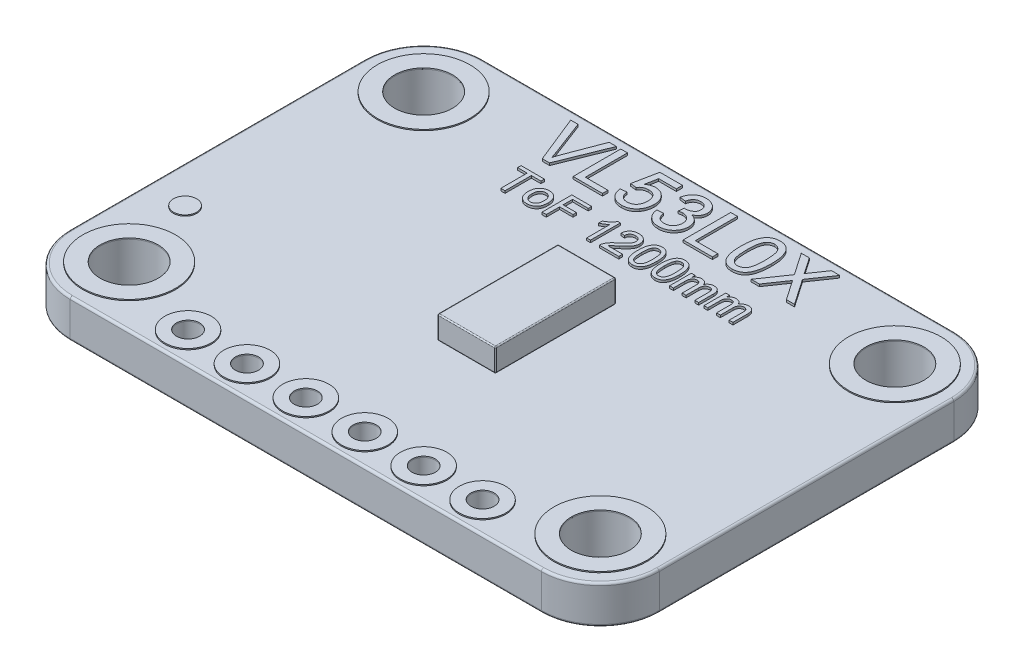
from build123d import *
from build123d.topology import SkipClean

# Parameters (mm, degrees)
SKETCH1_R               = 1.25
SKETCH1_R_2             = 0.5
BOSS_EXTRUDE1_DEPTH     = 1.65
SKETCH2_W               = 2.5
SKETCH2_H               = 5.2
BNO055_IC_DEPTH         = 1
FILLET1_R               = 0.1
FILLET2_R               = 0.05
SKETCH16_R              = 2
SKETCH16_R_2            = 1.25
BOSS_EXTRUDE10_DEPTH    = 0.05
BOSS_EXTRUDE10_2_DEPTH  = 0.05
BOSS_EXTRUDE10_3_DEPTH  = 0.05
BOSS_EXTRUDE10_4_DEPTH  = 0.05
SKETCH16_R_3            = 1
SKETCH16_R_4            = 0.5
BOSS_EXTRUDE10_5_DEPTH  = 0.05
BOSS_EXTRUDE10_6_DEPTH  = 0.05
BOSS_EXTRUDE10_7_DEPTH  = 0.05
BOSS_EXTRUDE10_8_DEPTH  = 0.05
BOSS_EXTRUDE10_9_DEPTH  = 0.05
BOSS_EXTRUDE10_10_DEPTH = 0.05
BOSS_EXTRUDE10_11_DEPTH = 0.05
BOSS_EXTRUDE14_DEPTH    = 0.1


with BuildPart() as part:
    # Sketch1 → Boss-Extrude1 (new body)
    with BuildSketch(Plane(origin=(0, 0, 0), x_dir=(1, 0, 0), z_dir=(0, 1, 0))):
        with BuildLine():
            Line((2.54, 0), (22.86, 0))
            ThreePointArc((22.86, 0), (24.656051224, 0.743948776), (25.4, 2.54))
            Line((25.4, 2.54), (25.4, 15.24))
            ThreePointArc((25.4, 15.24), (24.656051224, 17.036051224), (22.86, 17.78))
            Line((22.86, 17.78), (2.54, 17.78))
            ThreePointArc((2.54, 17.78), (0.743948776, 17.036051224), (0, 15.24))
            Line((0, 15.24), (0, 2.54))
            ThreePointArc((0, 2.54), (0.743948776, 0.743948776), (2.54, 0))
        make_face()
        with Locations(Location((2.54, 2.54, 0), (0, 0, 270))):
            Circle(SKETCH1_R, mode=Mode.SUBTRACT)
        with Locations(Location((2.54, 15.24, 0), (0, 0, 90))):
            Circle(SKETCH1_R, mode=Mode.SUBTRACT)
        with Locations(Location((22.86, 2.54, 0), (0, 0, 90))):
            Circle(SKETCH1_R, mode=Mode.SUBTRACT)
        with Locations(Location((22.86, 15.24, 0), (0, 0, 270))):
            Circle(SKETCH1_R, mode=Mode.SUBTRACT)
        with Locations(Location((19.05, 1.27, 0), (0, 0, 270))):
            Circle(SKETCH1_R_2, mode=Mode.SUBTRACT)
        with Locations(Location((16.51, 1.27, 0), (0, 0, 270))):
            Circle(SKETCH1_R_2, mode=Mode.SUBTRACT)
        with Locations(Location((13.97, 1.27, 0), (0, 0, 270))):
            Circle(SKETCH1_R_2, mode=Mode.SUBTRACT)
        with Locations(Location((11.43, 1.27, 0), (0, 0, 270))):
            Circle(SKETCH1_R_2, mode=Mode.SUBTRACT)
        with Locations(Location((8.89, 1.27, 0), (0, 0, 270))):
            Circle(SKETCH1_R_2, mode=Mode.SUBTRACT)
        with Locations(Location((6.35, 1.27, 0), (0, 0, 270))):
            Circle(SKETCH1_R_2, mode=Mode.SUBTRACT)
    extrude(amount=BOSS_EXTRUDE1_DEPTH)

    # Fillet1
    fillet1_edges = [part.edges().sort_by_distance(p)[0] for p in [
        (24.656051224, 1.65, -17.036051224),
        (25.4, 0, -8.89),
        (24.656051224, 0, -0.743948776),
        (12.7, 1.65, -17.78),
        (0.743948776, 1.65, -17.036051224),
        (0, 1.65, -8.89),
        (0.743948776, 1.65, -0.743948776),
        (12.7, 1.65, 0),
        (24.656051224, 1.65, -0.743948776),
        (25.4, 1.65, -8.89),
        (12.7, 0, 0),
        (0.743948776, 0, -0.743948776),
        (0, 0, -8.89),
        (0.743948776, 0, -17.036051224),
        (12.7, 0, -17.78),
        (24.656051224, 0, -17.036051224),
    ]]
    fillet(fillet1_edges, radius=FILLET1_R)


with BuildPart() as body_2:
    # Sketch2 → BNO055_IC (new body)
    with BuildSketch(Plane(origin=(0, 1.65, 0), x_dir=(1, 0, 0), z_dir=(0, 1, 0))):
        with Locations((13.335, 8.89)):
            Rectangle(SKETCH2_W, SKETCH2_H)
    extrude(amount=BNO055_IC_DEPTH)

    # Fillet2
    fillet2_edges = [body_2.edges().sort_by_distance(p)[0] for p in [
        (14.585, 2.65, -8.89),
        (13.335, 2.65, -11.49),
        (12.085, 2.65, -8.89),
        (13.335, 1.65, -11.49),
        (14.585, 1.65, -8.89),
        (13.335, 1.65, -6.29),
        (12.085, 1.65, -8.89),
        (13.335, 2.65, -6.29),
        (12.085, 2.15, -11.49),
        (14.585, 2.15, -11.49),
        (14.585, 2.15, -6.29),
        (12.085, 2.15, -6.29),
    ]]
    fillet(fillet2_edges, radius=FILLET2_R)


with BuildPart() as body_3:
    # Sketch16 → Boss-Extrude10 (new body)
    with BuildSketch(Plane(origin=(0, 1.65, 0), x_dir=(1, 0, 0), z_dir=(0, 1, 0))):
        with Locations(Location((2.54, 2.54, 0), (0, 0, 270))):
            Circle(SKETCH16_R)
        with Locations(Location((2.54, 2.54, 0), (0, 0, 270))):
            Circle(SKETCH16_R_2, mode=Mode.SUBTRACT)
    boss_extrude10 = extrude(amount=BOSS_EXTRUDE10_DEPTH)


with BuildPart() as body_4:
    # Sketch16 → Boss-Extrude10 2 (new body)
    with BuildSketch(Plane(origin=(0, 1.65, 0), x_dir=(1, 0, 0), z_dir=(0, 1, 0))):
        with Locations(Location((2.54, 15.24, 0), (0, 0, 270))):
            Circle(SKETCH16_R)
        with Locations(Location((2.54, 15.24, 0), (0, 0, 270))):
            Circle(SKETCH16_R_2, mode=Mode.SUBTRACT)
    boss_extrude10_2 = extrude(amount=BOSS_EXTRUDE10_2_DEPTH)


with BuildPart() as body_5:
    # Sketch16 → Boss-Extrude10 3 (new body)
    with BuildSketch(Plane(origin=(0, 1.65, 0), x_dir=(1, 0, 0), z_dir=(0, 1, 0))):
        with Locations(Location((22.86, 15.24, 0), (0, 0, 270))):
            Circle(SKETCH16_R)
        with Locations(Location((22.86, 15.24, 0), (0, 0, 270))):
            Circle(SKETCH16_R_2, mode=Mode.SUBTRACT)
    boss_extrude10_3 = extrude(amount=BOSS_EXTRUDE10_3_DEPTH)


with BuildPart() as body_6:
    # Sketch16 → Boss-Extrude10 4 (new body)
    with BuildSketch(Plane(origin=(0, 1.65, 0), x_dir=(1, 0, 0), z_dir=(0, 1, 0))):
        with Locations(Location((22.86, 2.54, 0), (0, 0, 270))):
            Circle(SKETCH16_R)
        with Locations(Location((22.86, 2.54, 0), (0, 0, 270))):
            Circle(SKETCH16_R_2, mode=Mode.SUBTRACT)
    boss_extrude10_4 = extrude(amount=BOSS_EXTRUDE10_4_DEPTH)


with BuildPart() as body_7:
    # Sketch16 → Boss-Extrude10 5 (new body)
    with BuildSketch(Plane(origin=(0, 1.65, 0), x_dir=(1, 0, 0), z_dir=(0, 1, 0))):
        with Locations(Location((19.05, 1.27, 0), (0, 0, 270))):
            Circle(SKETCH16_R_3)
        with Locations(Location((19.05, 1.27, 0), (0, 0, 270))):
            Circle(SKETCH16_R_4, mode=Mode.SUBTRACT)
    boss_extrude10_5 = extrude(amount=BOSS_EXTRUDE10_5_DEPTH)


with BuildPart() as body_8:
    # Sketch16 → Boss-Extrude10 6 (new body)
    with BuildSketch(Plane(origin=(0, 1.65, 0), x_dir=(1, 0, 0), z_dir=(0, 1, 0))):
        with Locations(Location((16.51, 1.27, 0), (0, 0, 270))):
            Circle(SKETCH16_R_3)
        with Locations(Location((16.51, 1.27, 0), (0, 0, 270))):
            Circle(SKETCH16_R_4, mode=Mode.SUBTRACT)
    boss_extrude10_6 = extrude(amount=BOSS_EXTRUDE10_6_DEPTH)


with BuildPart() as body_9:
    # Sketch16 → Boss-Extrude10 7 (new body)
    with BuildSketch(Plane(origin=(0, 1.65, 0), x_dir=(1, 0, 0), z_dir=(0, 1, 0))):
        with Locations(Location((13.97, 1.27, 0), (0, 0, 270))):
            Circle(SKETCH16_R_3)
        with Locations(Location((13.97, 1.27, 0), (0, 0, 270))):
            Circle(SKETCH16_R_4, mode=Mode.SUBTRACT)
    boss_extrude10_7 = extrude(amount=BOSS_EXTRUDE10_7_DEPTH)


with BuildPart() as body_10:
    # Sketch16 → Boss-Extrude10 8 (new body)
    with BuildSketch(Plane(origin=(0, 1.65, 0), x_dir=(1, 0, 0), z_dir=(0, 1, 0))):
        with Locations(Location((11.43, 1.27, 0), (0, 0, 270))):
            Circle(SKETCH16_R_3)
        with Locations(Location((11.43, 1.27, 0), (0, 0, 270))):
            Circle(SKETCH16_R_4, mode=Mode.SUBTRACT)
    boss_extrude10_8 = extrude(amount=BOSS_EXTRUDE10_8_DEPTH)


with BuildPart() as body_11:
    # Sketch16 → Boss-Extrude10 9 (new body)
    with BuildSketch(Plane(origin=(0, 1.65, 0), x_dir=(1, 0, 0), z_dir=(0, 1, 0))):
        with Locations(Location((8.89, 1.27, 0), (0, 0, 270))):
            Circle(SKETCH16_R_3)
        with Locations(Location((8.89, 1.27, 0), (0, 0, 270))):
            Circle(SKETCH16_R_4, mode=Mode.SUBTRACT)
    boss_extrude10_9 = extrude(amount=BOSS_EXTRUDE10_9_DEPTH)


with BuildPart() as body_12:
    # Sketch16 → Boss-Extrude10 10 (new body)
    with BuildSketch(Plane(origin=(0, 1.65, 0), x_dir=(1, 0, 0), z_dir=(0, 1, 0))):
        with Locations(Location((6.35, 1.27, 0), (0, 0, 270))):
            Circle(SKETCH16_R_3)
        with Locations(Location((6.35, 1.27, 0), (0, 0, 270))):
            Circle(SKETCH16_R_4, mode=Mode.SUBTRACT)
    boss_extrude10_10 = extrude(amount=BOSS_EXTRUDE10_10_DEPTH)


with BuildPart() as body_13:
    # Sketch16 → Boss-Extrude10 11 (new body)
    with BuildSketch(Plane(origin=(0, 1.65, 0), x_dir=(1, 0, 0), z_dir=(0, 1, 0))):
        with Locations(Location((1.651, 5.842, 0), (0, 0, 270))):
            Circle(SKETCH16_R_4)
    boss_extrude10_11 = extrude(amount=BOSS_EXTRUDE10_11_DEPTH)


with BuildPart() as part_1:
    with SkipClean():  # the faces are left unmerged after this step: merging them gives an invalid solid
        add(part.part)

        # Mirror1: Boss-Extrude10, Boss-Extrude10 2, Boss-Extrude10 3, Boss-Extrude10 4, Boss-Extrude10 5, Boss-Extrude10 6, Boss-Extrude10 7, Boss-Extrude10 8, Boss-Extrude10 9, Boss-Extrude10 10, Boss-Extrude10 11 across plane
        add(boss_extrude10.mirror(Plane.ZX.offset(0.825)))
        add(boss_extrude10_2.mirror(Plane.ZX.offset(0.825)))
        add(boss_extrude10_3.mirror(Plane.ZX.offset(0.825)))
        add(boss_extrude10_4.mirror(Plane.ZX.offset(0.825)))
        add(boss_extrude10_5.mirror(Plane.ZX.offset(0.825)))
        add(boss_extrude10_6.mirror(Plane.ZX.offset(0.825)))
        add(boss_extrude10_7.mirror(Plane.ZX.offset(0.825)))
        add(boss_extrude10_8.mirror(Plane.ZX.offset(0.825)))
        add(boss_extrude10_9.mirror(Plane.ZX.offset(0.825)))
        add(boss_extrude10_10.mirror(Plane.ZX.offset(0.825)))
        add(boss_extrude10_11.mirror(Plane.ZX.offset(0.825)))

    # Sketch22 → Boss-Extrude14 (add)
    # profile 1 of 16: a face of its own
    with SkipClean():  # the faces are left unmerged after this step: merging them gives an invalid solid
        with BuildSketch(Plane(origin=(0, 1.65, 0), x_dir=(1, 0, 0), z_dir=(0, 1, 0))):
            with BuildLine():
                Line((7.656381865, 15.24), (6.827852135, 17.294654948))
                Line((6.827852135, 17.294654948), (7.141894949, 17.294654948))
                Line((7.141894949, 17.294654948), (7.700833534, 15.821987599))
                add(Edge.make_bspline(
                    [(7.700833534, 15.821987599), (7.711771408, 15.792938604), (7.733168146, 15.736112778), (7.763005913, 15.651787148), (7.789679081, 15.570239966), (7.805759996, 15.51648443), (7.813609066, 15.490246436)],
                    knots=[0, 0, 0, 0, 1.062747156, 2.078952616, 3.062339733, 4, 4, 4, 4], degree=3))
                add(Edge.make_bspline(
                    [(7.813609066, 15.490246436), (7.83031858, 15.54573062), (7.86397718, 15.657494496), (7.904662417, 15.766896998), (7.92514983, 15.821987599)],
                    knots=[0, 0, 0, 0, 0.992882236, 2, 2, 2, 2], degree=3))
                Line((7.92514983, 15.821987599), (8.485323184, 17.294654948))
                Line((8.485323184, 17.294654948), (8.799365997, 17.294654948))
                Line((8.799365997, 17.294654948), (7.970424678, 15.24))
                Line((7.970424678, 15.24), (7.656381865, 15.24))
            make_face()
        # profile 2 of 16: a face of its own
        with BuildSketch(Plane(origin=(0, 1.65, 0), x_dir=(1, 0, 0), z_dir=(0, 1, 0))):
            Polygon((8.985816056, 15.24), (8.985816056, 17.294654948), (9.275575087, 17.294654948), (9.275575087, 15.477075571), (10.250219101, 15.477075571), (10.250219101, 15.24), align=None)
        # profile 3 of 16: a face of its own
        with BuildSketch(Plane(origin=(0, 1.65, 0), x_dir=(1, 0, 0), z_dir=(0, 1, 0))):
            with BuildLine():
                Line((10.460952941, 15.793176332), (10.724370242, 15.819518062))
                add(Edge.make_bspline(
                    [(10.724370242, 15.819518062), (10.726978487, 15.804675943), (10.732051929, 15.775805713), (10.741719933, 15.734015198), (10.754275919, 15.695190642), (10.76838395, 15.658995802), (10.785153726, 15.625813392), (10.803323917, 15.59511948), (10.824751945, 15.568003604), (10.847280638, 15.543047578), (10.8720076, 15.521056906), (10.899171428, 15.502518011), (10.928014234, 15.486343947), (10.95888731, 15.473101342), (10.991837975, 15.463408453), (11.026446854, 15.455743042), (11.0631596, 15.451880477), (11.088208455, 15.451120941), (11.100974665, 15.450733841)],
                    knots=[0, 0, 0, 0, 1.237781394, 2.407677316, 3.51963579, 4.58689595, 5.594855907, 6.570874, 7.510833816, 8.428091223, 9.330271693, 10.221190844, 11.124215526, 12.043132878, 12.973586933, 13.941700858, 14.950982896, 16, 16, 16, 16], degree=3))
                add(Edge.make_bspline(
                    [(11.100974665, 15.450733841), (11.116635944, 15.451112263), (11.147262258, 15.451852283), (11.191817742, 15.458111081), (11.233904006, 15.468431112), (11.273319673, 15.48287323), (11.310526814, 15.500833712), (11.344291107, 15.524089264), (11.376453565, 15.550230803), (11.404944528, 15.581396535), (11.430879309, 15.61532564), (11.453262975, 15.652360701), (11.472106859, 15.691981902), (11.48797135, 15.734181647), (11.499686118, 15.779201008), (11.508303277, 15.826800491), (11.513835149, 15.877010417), (11.514356093, 15.911424973), (11.514622145, 15.929000878)],
                    knots=[0, 0, 0, 0, 1.052816602, 2.058828735, 3.018813999, 3.961574988, 4.877590722, 5.788574389, 6.712363302, 7.658909047, 8.620312049, 9.580784896, 10.562948504, 11.56722449, 12.607883026, 13.686460295, 14.818448981, 16, 16, 16, 16], degree=3))
                add(Edge.make_bspline(
                    [(11.514622145, 15.929000878), (11.514319755, 15.945750486), (11.51373093, 15.978365858), (11.508772066, 16.025859263), (11.500405879, 16.070517436), (11.489580816, 16.112832589), (11.474659833, 16.152143495), (11.456962706, 16.189020124), (11.435282981, 16.222679845), (11.411162858, 16.254170701), (11.383614631, 16.282400984), (11.35226613, 16.306237882), (11.318347137, 16.327099982), (11.28117449, 16.344017843), (11.240726299, 16.356587179), (11.197404507, 16.366258151), (11.150759588, 16.371344687), (11.118683554, 16.372236409), (11.102209434, 16.372694394)],
                    knots=[0, 0, 0, 0, 1.165854935, 2.270189951, 3.319242023, 4.32700288, 5.306253956, 6.24172124, 7.169108591, 8.088047231, 8.999810445, 9.905349262, 10.822648491, 11.767237767, 12.739852311, 13.766490849, 14.852878837, 16, 16, 16, 16], degree=3))
                add(Edge.make_bspline(
                    [(11.102209434, 16.372694394), (11.081724665, 16.372095175), (11.042439514, 16.370946007), (10.985990792, 16.361278474), (10.934603477, 16.345661804), (10.888859373, 16.322387059), (10.847989277, 16.294581553), (10.811144135, 16.263118361), (10.778020119, 16.228018755), (10.759850249, 16.201592826), (10.750711972, 16.188302284)],
                    knots=[0, 0, 0, 0, 1.182877094, 2.268490576, 3.298955169, 4.273890847, 5.221533034, 6.149304476, 7.069219215, 8, 8, 8, 8], degree=3))
                Line((10.750711972, 16.188302284), (10.487294671, 16.214644014))
                Line((10.487294671, 16.214644014), (10.698028512, 17.268313218))
                Line((10.698028512, 17.268313218), (11.672672526, 17.268313218))
                Line((11.672672526, 17.268313218), (11.672672526, 17.004895917))
                Line((11.672672526, 17.004895917), (10.913289838, 17.004895917))
                Line((10.913289838, 17.004895917), (10.808746097, 16.472710651))
                add(Edge.make_bspline(
                    [(10.808746097, 16.472710651), (10.823280758, 16.483617664), (10.851824533, 16.505037314), (10.896347707, 16.533083521), (10.941507515, 16.556724603), (10.987041071, 16.576084662), (11.033310068, 16.591166114), (11.080035296, 16.60164401), (11.127375848, 16.608725589), (11.159120481, 16.609420847), (11.175060781, 16.609769965)],
                    knots=[0, 0, 0, 0, 1.093835215, 2.148119334, 3.164235237, 4.159999629, 5.123971815, 6.089888814, 7.040853737, 8, 8, 8, 8], degree=3))
                add(Edge.make_bspline(
                    [(11.175060781, 16.609769965), (11.195806001, 16.609226424), (11.23665837, 16.60815606), (11.296855752, 16.599361668), (11.354414574, 16.584432604), (11.409786325, 16.564325332), (11.462240863, 16.537669708), (11.512309514, 16.505395408), (11.559790134, 16.467236403), (11.604414303, 16.423912675), (11.644890198, 16.375818782), (11.681117445, 16.324523242), (11.710705882, 16.268999257), (11.735591788, 16.21069657), (11.754361271, 16.148658119), (11.768607964, 16.083764359), (11.776225198, 16.015203967), (11.777425232, 15.9685303), (11.778039446, 15.94464128)],
                    knots=[0, 0, 0, 0, 0.991958705, 1.953407265, 2.902004973, 3.832128134, 4.765371166, 5.71007953, 6.676509202, 7.674246545, 8.68000108, 9.679398714, 10.671856529, 11.683459888, 12.706765812, 13.76733029, 14.85725088, 16, 16, 16, 16], degree=3))
                add(Edge.make_bspline(
                    [(11.778039446, 15.94464128), (11.777573041, 15.921847228), (11.776651757, 15.87682247), (11.769101641, 15.810470165), (11.756664621, 15.746534497), (11.740014883, 15.684826133), (11.717518852, 15.625695527), (11.690233272, 15.568951684), (11.658757826, 15.514002501), (11.633516151, 15.480129501), (11.620812245, 15.463081527)],
                    knots=[0, 0, 0, 0, 1.059692978, 2.093196008, 3.100373587, 4.086253034, 5.061402885, 6.037282833, 7.012182238, 8, 8, 8, 8], degree=3))
                add(Edge.make_bspline(
                    [(11.620812245, 15.463081527), (11.604672288, 15.443181176), (11.572923261, 15.404035049), (11.517950166, 15.353225719), (11.45885331, 15.310044782), (11.395281, 15.274963399), (11.327660018, 15.246772538), (11.255159657, 15.228012578), (11.178655961, 15.215414522), (11.12613469, 15.214251742), (11.099328307, 15.21365827)],
                    knots=[0, 0, 0, 0, 1.023140956, 2.012628108, 2.982342558, 3.942221589, 4.908720554, 5.902469194, 6.929439212, 8, 8, 8, 8], degree=3))
                add(Edge.make_bspline(
                    [(11.099328307, 15.21365827), (11.077217294, 15.214106788), (11.033963714, 15.21498418), (10.970632778, 15.222611809), (10.910397569, 15.234775187), (10.853239215, 15.252221237), (10.798985516, 15.274265954), (10.748267098, 15.302270303), (10.700203799, 15.334305535), (10.65585285, 15.371358648), (10.615443362, 15.412687114), (10.57923564, 15.457415272), (10.547719673, 15.505572288), (10.520910672, 15.55687), (10.498566608, 15.611259214), (10.481472516, 15.669111156), (10.467932572, 15.729858209), (10.463303879, 15.771848989), (10.460952941, 15.793176332)],
                    knots=[0, 0, 0, 0, 1.108768375, 2.168973506, 3.19473529, 4.187459816, 5.162590879, 6.12651078, 7.088512529, 8.056012598, 9.019588496, 9.983680353, 10.938070192, 11.90157236, 12.88306954, 13.882379887, 14.924449348, 16, 16, 16, 16], degree=3))
            make_face()
        # profile 4 of 16: a face of its own
        with BuildSketch(Plane(origin=(0, 1.65, 0), x_dir=(1, 0, 0), z_dir=(0, 1, 0))):
            with BuildLine():
                Line((12.041456747, 15.793176332), (12.304874048, 15.819518062))
                add(Edge.make_bspline(
                    [(12.304874048, 15.819518062), (12.308385717, 15.803690391), (12.315180534, 15.77306502), (12.328254592, 15.729190996), (12.342063669, 15.68846609), (12.359182701, 15.651801222), (12.375887155, 15.61769695), (12.395517418, 15.587562431), (12.416492736, 15.560611414), (12.43920087, 15.536943975), (12.463903493, 15.51656342), (12.490271263, 15.498729336), (12.518861834, 15.483835474), (12.54945631, 15.472043165), (12.581797012, 15.462497191), (12.616059695, 15.455487755), (12.652425535, 15.451312146), (12.677351367, 15.450929755), (12.690121851, 15.450733841)],
                    knots=[0, 0, 0, 0, 1.321063709, 2.556160278, 3.730472002, 4.821700466, 5.852032229, 6.822994757, 7.746964065, 8.632786469, 9.490489437, 10.352773447, 11.223141997, 12.11199479, 13.021433979, 13.96892724, 14.959401504, 16, 16, 16, 16], degree=3))
                add(Edge.make_bspline(
                    [(12.690121851, 15.450733841), (12.705101176, 15.45094741), (12.734355823, 15.45136451), (12.776984668, 15.457622609), (12.817553532, 15.466215576), (12.855483604, 15.479689839), (12.891303039, 15.496157879), (12.924807773, 15.516508884), (12.956227144, 15.540406056), (12.984941426, 15.568011947), (13.010620538, 15.598379306), (13.033491394, 15.630454988), (13.05240252, 15.664512684), (13.068341751, 15.700072683), (13.080106989, 15.737709616), (13.088720092, 15.77695417), (13.0943488, 15.817983825), (13.094863346, 15.845978136), (13.095125952, 15.860265426)],
                    knots=[0, 0, 0, 0, 1.111377895, 2.170522867, 3.193923215, 4.186422864, 5.152846954, 6.117443035, 7.091571248, 8.078879332, 9.069127402, 10.041602243, 10.999610288, 11.957618333, 12.930786866, 13.922135183, 14.939532534, 16, 16, 16, 16], degree=3))
                add(Edge.make_bspline(
                    [(13.095125952, 15.860265426), (13.094817312, 15.873861964), (13.094213485, 15.900462506), (13.089249532, 15.939506395), (13.080587545, 15.976569577), (13.06857996, 16.01186655), (13.053236731, 16.045345495), (13.034794621, 16.077283251), (13.012238409, 16.106979902), (12.986849404, 16.134754416), (12.959157406, 16.160342712), (12.928852768, 16.182108851), (12.896960899, 16.200893738), (12.863101721, 16.2160618), (12.82741582, 16.228100777), (12.789937214, 16.236753427), (12.750485715, 16.241719533), (12.723611843, 16.242323466), (12.709878149, 16.242632102)],
                    knots=[0, 0, 0, 0, 1.072815875, 2.098878726, 3.09954706, 4.07199174, 5.036203424, 6.001873089, 6.97636515, 7.972747947, 8.969130744, 9.945905975, 10.911575641, 11.885646534, 12.868345115, 13.879560892, 14.916365174, 16, 16, 16, 16], degree=3))
                add(Edge.make_bspline(
                    [(12.709878149, 16.242632102), (12.697786465, 16.242311755), (12.672125093, 16.241631905), (12.63162286, 16.235629082), (12.586759777, 16.227223722), (12.555758106, 16.218975107), (12.539480082, 16.214644014)],
                    knots=[0, 0, 0, 0, 0.837610211, 1.777604146, 2.833088267, 4, 4, 4, 4], degree=3))
                Line((12.539480082, 16.214644014), (12.566644991, 16.451719585))
                add(Edge.make_bspline(
                    [(12.566644991, 16.451719585), (12.573772428, 16.450940751), (12.586364156, 16.449564819), (12.599019382, 16.449058276), (12.604511228, 16.448838458)],
                    knots=[0, 0, 0, 0, 1.132082448, 2, 2, 2, 2], degree=3))
                add(Edge.make_bspline(
                    [(12.604511228, 16.448838458), (12.628736897, 16.449763385), (12.676260044, 16.4515778), (12.745539579, 16.466654073), (12.81119626, 16.490391177), (12.861920287, 16.518712987), (12.899535511, 16.545351187), (12.923254915, 16.569369303), (12.944639182, 16.594857376), (12.960593593, 16.624093119), (12.974377219, 16.655156802), (12.982912699, 16.689272106), (12.989137468, 16.725609777), (12.989548124, 16.750778235), (12.989759031, 16.763704451)],
                    knots=[0, 0, 0, 0, 1.557468908, 3.055264441, 4.54122591, 6.035034992, 6.780215604, 7.498173296, 8.201377046, 8.913174237, 9.633083494, 10.382644491, 11.169345745, 12, 12, 12, 12], degree=3))
                add(Edge.make_bspline(
                    [(12.989759031, 16.763704451), (12.989564379, 16.774145391), (12.989183694, 16.794564925), (12.984942694, 16.824502119), (12.9779286, 16.852868531), (12.968448354, 16.879967038), (12.956023551, 16.905655621), (12.940615819, 16.929902831), (12.923011963, 16.953200542), (12.902231234, 16.974344882), (12.879976876, 16.994196277), (12.855437364, 17.010915223), (12.829780596, 17.025767549), (12.802101715, 17.036990758), (12.773084049, 17.046218066), (12.742479549, 17.05268419), (12.710277046, 17.057026626), (12.688216017, 17.057392533), (12.676950986, 17.057579377)],
                    knots=[0, 0, 0, 0, 1.041493611, 2.036867705, 3.009952345, 3.954088258, 4.897230656, 5.850851638, 6.817653571, 7.805463921, 8.805067469, 9.788883576, 10.763797054, 11.758134544, 12.762883247, 13.799594994, 14.876406454, 16, 16, 16, 16], degree=3))
                add(Edge.make_bspline(
                    [(12.676950986, 17.057579377), (12.654905605, 17.056719791), (12.612332708, 17.055059804), (12.551380419, 17.039701476), (12.49614664, 17.014849704), (12.455254213, 16.985705513), (12.426216994, 16.957842017), (12.406383035, 16.934224492), (12.388642683, 16.908143856), (12.372945658, 16.879609407), (12.359504032, 16.848506388), (12.347386779, 16.815220121), (12.338006901, 16.779217691), (12.33351786, 16.754271556), (12.331215779, 16.741478616)],
                    knots=[0, 0, 0, 0, 1.533565899, 2.961543033, 4.347411787, 5.731829577, 6.434842101, 7.147085226, 7.87612511, 8.629021686, 9.412189982, 10.234506416, 11.094615066, 12, 12, 12, 12], degree=3))
                Line((12.331215779, 16.741478616), (12.067798478, 16.767820346))
                add(Edge.make_bspline(
                    [(12.067798478, 16.767820346), (12.07191911, 16.788188058), (12.080002056, 16.828140929), (12.096469649, 16.885843762), (12.116551675, 16.94001029), (12.140663522, 16.990392171), (12.167666068, 17.037592357), (12.198815465, 17.08105098), (12.233381414, 17.121026408), (12.271425313, 17.157396709), (12.312430694, 17.189879456), (12.356191024, 17.217900088), (12.402347178, 17.241651611), (12.45094237, 17.260799541), (12.501938125, 17.27636971), (12.555479522, 17.286684985), (12.611324215, 17.293662749), (12.649352176, 17.294320146), (12.668719196, 17.294654948)],
                    knots=[0, 0, 0, 0, 1.136581168, 2.229493434, 3.279335563, 4.293305329, 5.282068175, 6.250623624, 7.213783178, 8.169396253, 9.125981663, 10.071280146, 11.007896369, 11.961295906, 12.925420184, 13.920544621, 14.940967302, 16, 16, 16, 16], degree=3))
                add(Edge.make_bspline(
                    [(12.668719196, 17.294654948), (12.695527761, 17.293785612), (12.748242069, 17.292076217), (12.825667102, 17.278499993), (12.899723739, 17.256221138), (12.969816051, 17.225338674), (13.034738136, 17.187601116), (13.09218883, 17.142374952), (13.141400095, 17.090442583), (13.181416111, 17.032371782), (13.213103183, 16.970543732), (13.236550663, 16.906363535), (13.250560884, 16.839905072), (13.252302743, 16.794912709), (13.253176332, 16.772347831)],
                    knots=[0, 0, 0, 0, 1.104647871, 2.172094857, 3.229560912, 4.285649672, 5.322588163, 6.317201348, 7.289435229, 8.260615662, 9.214246199, 10.146367077, 11.070353327, 12, 12, 12, 12], degree=3))
                add(Edge.make_bspline(
                    [(13.253176332, 16.772347831), (13.252290688, 16.751017321), (13.250542025, 16.708901251), (13.237079387, 16.647320097), (13.214330207, 16.588978878), (13.183581858, 16.533672901), (13.143708794, 16.482598203), (13.094820534, 16.437085991), (13.037699161, 16.396700783), (12.994891524, 16.375680729), (12.97288386, 16.364874193)],
                    knots=[0, 0, 0, 0, 0.975609618, 1.926294443, 2.868398979, 3.832526731, 4.812148358, 5.820404151, 6.879456693, 8, 8, 8, 8], degree=3))
                add(Edge.make_bspline(
                    [(12.97288386, 16.364874193), (12.98763853, 16.361148931), (13.016538622, 16.35385223), (13.058045708, 16.33873367), (13.097067028, 16.321033641), (13.134121932, 16.300986274), (13.168134646, 16.277277013), (13.200277558, 16.251353625), (13.229335591, 16.22196762), (13.256150609, 16.190166367), (13.280548983, 16.156282673), (13.301080454, 16.119657424), (13.318798516, 16.081253431), (13.333906796, 16.040792154), (13.344763571, 15.997961604), (13.352526509, 15.953093591), (13.357649414, 15.906344), (13.358242386, 15.874410252), (13.358543253, 15.858207478)],
                    knots=[0, 0, 0, 0, 1.053251915, 2.063013066, 3.05373318, 4.018979697, 4.975584284, 5.920798056, 6.874756953, 7.832116109, 8.799604348, 9.761196922, 10.734637845, 11.72654167, 12.747371341, 13.789206138, 14.878271633, 16, 16, 16, 16], degree=3))
                add(Edge.make_bspline(
                    [(13.358543253, 15.858207478), (13.3580419, 15.836086795), (13.357056583, 15.792612555), (13.347715739, 15.728747906), (13.332450705, 15.667556986), (13.311325945, 15.608832003), (13.284557531, 15.552333289), (13.250967587, 15.498858138), (13.211551641, 15.447971868), (13.166925908, 15.400161697), (13.118034147, 15.356222679), (13.064939565, 15.31817569), (13.008692634, 15.285865588), (12.949201821, 15.259516859), (12.886624836, 15.238815869), (12.820899427, 15.223976738), (12.751822209, 15.215255629), (12.704689786, 15.21419773), (12.680655292, 15.21365827)],
                    knots=[0, 0, 0, 0, 1.016055063, 1.996874249, 2.958724482, 3.910019225, 4.860394196, 5.826121543, 6.806008102, 7.814207964, 8.82789325, 9.821757317, 10.810247154, 11.803791187, 12.806673825, 13.834534493, 14.895752369, 16, 16, 16, 16], degree=3))
                add(Edge.make_bspline(
                    [(12.680655292, 15.21365827), (12.659086329, 15.214064542), (12.616624368, 15.214864352), (12.554468826, 15.223197019), (12.494920586, 15.235022029), (12.438450521, 15.253251704), (12.384402683, 15.275482498), (12.333692444, 15.303923445), (12.285407998, 15.33657255), (12.240455822, 15.374362607), (12.199085562, 15.416072951), (12.162178341, 15.461086652), (12.130485859, 15.509303765), (12.102542724, 15.560002869), (12.079957445, 15.61413967), (12.062371229, 15.671249366), (12.048961503, 15.731120008), (12.043985551, 15.772265822), (12.041456747, 15.793176332)],
                    knots=[0, 0, 0, 0, 1.08471039, 2.135426191, 3.150939737, 4.135689946, 5.116584603, 6.086901885, 7.055842759, 8.045878862, 9.036901429, 10.008421467, 10.96965771, 11.936653536, 12.917548193, 13.915472582, 14.940632654, 16, 16, 16, 16], degree=3))
            make_face()
        # profile 5 of 16: a face of its own
        with BuildSketch(Plane(origin=(0, 1.65, 0), x_dir=(1, 0, 0), z_dir=(0, 1, 0))):
            Polygon((13.727327474, 15.24), (13.727327474, 17.294654948), (14.017086505, 17.294654948), (14.017086505, 15.477075571), (14.991730519, 15.477075571), (14.991730519, 15.24), align=None)
        # profile 6 of 16: a face of its own
        with BuildSketch(Plane(origin=(0, 1.65, 0), x_dir=(1, 0, 0), z_dir=(0, 1, 0))):
            with BuildLine():
                add(Edge.make_bspline(
                    [(15.20246436, 16.25333343), (15.202729753, 16.282696335), (15.203249546, 16.340205901), (15.206473653, 16.424352728), (15.212102684, 16.504263485), (15.220505278, 16.579868774), (15.230455523, 16.65133925), (15.243390904, 16.718572918), (15.257945088, 16.781720628), (15.275407498, 16.840716558), (15.294592969, 16.896067965), (15.316359498, 16.947686055), (15.340849797, 16.995516098), (15.366860318, 17.04005412), (15.395760309, 17.080607372), (15.425805425, 17.118313943), (15.459179165, 17.151790986), (15.494493777, 17.181899869), (15.532269279, 17.208469203), (15.5723058, 17.231395334), (15.614449291, 17.251637455), (15.659502961, 17.266875718), (15.706531502, 17.279298133), (15.755896918, 17.288436212), (15.807653608, 17.293823417), (15.843022029, 17.29437464), (15.861007612, 17.294654948)],
                    knots=[0, 0, 0, 0, 1.514747001, 2.966751498, 4.343369068, 5.64627492, 6.890416844, 8.064737671, 9.177176366, 10.232018008, 11.237056675, 12.19799043, 13.119080079, 14.007588942, 14.855863561, 15.685992447, 16.491747269, 17.290132607, 18.077525251, 18.870243746, 19.668095604, 20.485086593, 21.319398728, 22.175900658, 23.072407314, 24, 24, 24, 24], degree=3))
                add(Edge.make_bspline(
                    [(15.861007612, 17.294654948), (15.887394801, 17.293879183), (15.939233493, 17.292355162), (16.01491825, 17.279925525), (16.086246256, 17.258662714), (16.153171168, 17.229978266), (16.214548917, 17.193543495), (16.269361834, 17.149251481), (16.317018673, 17.097567279), (16.356999333, 17.03787845), (16.391946421, 16.971831611), (16.422992646, 16.899130317), (16.451057533, 16.81985604), (16.470972987, 16.748894496), (16.485178664, 16.687637972), (16.494581694, 16.637115325), (16.502388093, 16.582601104), (16.50836885, 16.524227193), (16.51327592, 16.462059066), (16.517065426, 16.396058014), (16.518988988, 16.326059078), (16.519360061, 16.27802977), (16.519550865, 16.25333343)],
                    knots=[0, 0, 0, 0, 1.134486744, 2.228744715, 3.287356444, 4.328707449, 5.352829806, 6.347195599, 7.349461267, 8.364207941, 9.428085653, 10.559314403, 11.761222316, 13.04268526, 13.726896727, 14.465273606, 15.252205015, 16.094778733, 16.988606776, 17.934225168, 18.937792761, 20, 20, 20, 20], degree=3))
                add(Edge.make_bspline(
                    [(16.519550865, 16.25333343), (16.5192805, 16.224108446), (16.518752291, 16.167011689), (16.515614574, 16.083539578), (16.509646355, 16.004231709), (16.502302352, 15.92890641), (16.491192413, 15.857764764), (16.479220853, 15.79050451), (16.46441499, 15.727431068), (16.447140023, 15.668516795), (16.427684488, 15.613450173), (16.406348484, 15.56181504), (16.38271681, 15.513646677), (16.356086099, 15.469414897), (16.327674827, 15.428532594), (16.297274911, 15.390846412), (16.264241837, 15.356898762), (16.228608985, 15.326880189), (16.191098715, 15.299839686), (16.150964857, 15.276687205), (16.108383073, 15.257505776), (16.063637866, 15.241106608), (16.016275232, 15.229090259), (15.966668669, 15.219891932), (15.9146354, 15.214475291), (15.879130176, 15.213934368), (15.861007612, 15.21365827)],
                    knots=[0, 0, 0, 0, 1.508974709, 2.94807912, 4.311757619, 5.615040294, 6.854280449, 8.028314546, 9.141715822, 10.197470207, 11.196696834, 12.155719058, 13.080757287, 13.963948316, 14.818758719, 15.649605906, 16.461113142, 17.260189315, 18.052359509, 18.845763934, 19.647754795, 20.461145776, 21.303032214, 22.167241874, 23.064524267, 24, 24, 24, 24], degree=3))
                add(Edge.make_bspline(
                    [(15.861007612, 15.21365827), (15.83724683, 15.214336047), (15.790919845, 15.215657527), (15.7232627, 15.224636168), (15.65976286, 15.240438997), (15.599884741, 15.261632819), (15.544301389, 15.289980776), (15.492747416, 15.324471601), (15.444186882, 15.36430283), (15.416232487, 15.395728755), (15.402085283, 15.411632835)],
                    knots=[0, 0, 0, 0, 1.10322584, 2.150986741, 3.161425019, 4.136713905, 5.093944212, 6.049774532, 7.013026876, 8, 8, 8, 8], degree=3))
                add(Edge.make_bspline(
                    [(15.402085283, 15.411632835), (15.385801526, 15.435122393), (15.352223722, 15.483558868), (15.312923814, 15.56614755), (15.277867601, 15.657066094), (15.2503549, 15.75809831), (15.228805597, 15.868440095), (15.213241621, 15.988307965), (15.204433942, 16.117650132), (15.203135708, 16.207084674), (15.20246436, 16.25333343)],
                    knots=[0, 0, 0, 0, 0.779365345, 1.607084704, 2.489375761, 3.438383567, 4.461919411, 5.557722155, 6.737039282, 8, 8, 8, 8], degree=3))
            make_face()
            with BuildLine():
                add(Edge.make_bspline(
                    [(15.465881661, 16.254156609), (15.466143213, 16.214638121), (15.466643882, 16.138990994), (15.47187466, 16.030916022), (15.480879229, 15.933417645), (15.492783857, 15.846630855), (15.508502787, 15.770438257), (15.528239761, 15.705034013), (15.550488027, 15.649633124), (15.578019833, 15.60492224), (15.60816412, 15.568476348), (15.639286036, 15.537131701), (15.672117773, 15.51048947), (15.706445107, 15.488275282), (15.742800651, 15.471456158), (15.780786864, 15.45926562), (15.820412011, 15.452250153), (15.847398537, 15.451242162), (15.861007612, 15.450733841)],
                    knots=[0, 0, 0, 0, 1.89448813, 3.626469325, 5.185477471, 6.587276848, 7.82441448, 8.910550357, 9.859733512, 10.6775885, 11.416198291, 12.123144072, 12.791880183, 13.439617036, 14.078171869, 14.70637855, 15.347637704, 16, 16, 16, 16], degree=3))
                add(Edge.make_bspline(
                    [(15.861007612, 15.450733841), (15.87461328, 15.451253269), (15.901593048, 15.452283284), (15.941309752, 15.459144054), (15.97914817, 15.471962153), (16.015449508, 15.488721871), (16.050026343, 15.510429731), (16.082696833, 15.537172596), (16.113982694, 15.568498631), (16.143991573, 15.605368141), (16.171313626, 15.650285738), (16.193979241, 15.705641498), (16.213408626, 15.771160284), (16.229213808, 15.847314062), (16.241167545, 15.933963635), (16.250117671, 16.031191596), (16.255383454, 16.139127511), (16.255875861, 16.214637943), (16.256133564, 16.254156609)],
                    knots=[0, 0, 0, 0, 0.652509534, 1.29391342, 1.924290653, 2.562989607, 3.207355802, 3.876242846, 4.583348185, 5.32723334, 6.150888545, 7.094226006, 8.186903555, 9.424320409, 10.81992305, 12.379283064, 14.105084285, 16, 16, 16, 16], degree=3))
                add(Edge.make_bspline(
                    [(16.256133564, 16.254156609), (16.255884112, 16.29285302), (16.255406172, 16.366993878), (16.250004577, 16.472986783), (16.241539792, 16.56884869), (16.22996131, 16.654667974), (16.21457351, 16.730351467), (16.195910208, 16.796060288), (16.173670093, 16.851654304), (16.147226675, 16.897691956), (16.11778986, 16.93545532), (16.087040317, 16.968142798), (16.054209302, 16.995942433), (16.018715151, 17.01824371), (15.981701906, 17.036235551), (15.942319096, 17.048617994), (15.900953823, 17.05622538), (15.872565374, 17.057122888), (15.858126485, 17.057579377)],
                    knots=[0, 0, 0, 0, 1.850066095, 3.544656626, 5.0727657, 6.45041401, 7.682899467, 8.762389858, 9.712573485, 10.538438529, 11.291566246, 11.996865408, 12.681389046, 13.341983376, 13.996294293, 14.643563182, 15.31009126, 16, 16, 16, 16], degree=3))
                add(Edge.make_bspline(
                    [(15.858126485, 17.057579377), (15.844518265, 17.057222215), (15.817684597, 17.056517937), (15.778396594, 17.049795612), (15.741163815, 17.038554386), (15.705559692, 17.023327055), (15.672473064, 17.002834074), (15.640591798, 16.97890706), (15.611409088, 16.949754665), (15.593823844, 16.92796079), (15.584831036, 16.916815757)],
                    knots=[0, 0, 0, 0, 1.021318143, 2.013908504, 2.982026795, 3.937174072, 4.91255697, 5.897578595, 6.924855925, 8, 8, 8, 8], degree=3))
                add(Edge.make_bspline(
                    [(15.584831036, 16.916815757), (15.575040611, 16.900447155), (15.554365297, 16.865880115), (15.531230821, 16.805801176), (15.510794741, 16.737142384), (15.493969071, 16.658847374), (15.481796879, 16.571050453), (15.472187404, 16.473853581), (15.46719564, 16.36712106), (15.466331738, 16.292850334), (15.465881661, 16.254156609)],
                    knots=[0, 0, 0, 0, 0.671104906, 1.417232262, 2.260109084, 3.195198885, 4.23592645, 5.382417421, 6.636286093, 8, 8, 8, 8], degree=3))
            make_face(mode=Mode.SUBTRACT)
        # profile 7 of 16: a face of its own
        with BuildSketch(Plane(origin=(0, 1.65, 0), x_dir=(1, 0, 0), z_dir=(0, 1, 0))):
            with BuildLine():
                Line((16.663607201, 15.24), (17.422989889, 16.345529485))
                Line((17.422989889, 16.345529485), (16.768974122, 17.294654948))
                Line((16.768974122, 17.294654948), (17.118002045, 17.294654948))
                Line((17.118002045, 17.294654948), (17.476496529, 16.774405778))
                add(Edge.make_bspline(
                    [(17.476496529, 16.774405778), (17.485298415, 16.761387069), (17.501815447, 16.73695703), (17.524775899, 16.702304665), (17.543472893, 16.671551101), (17.559103381, 16.645141521), (17.570480265, 16.62264496), (17.578790147, 16.604476661), (17.583053362, 16.590078361), (17.583085418, 16.581796137), (17.583098218, 16.578489161)],
                    knots=[0, 0, 0, 0, 1.676306978, 3.145645595, 4.433208983, 5.515054297, 6.418236916, 7.119612403, 7.648473563, 8, 8, 8, 8], degree=3))
                add(Edge.make_bspline(
                    [(17.583098218, 16.578489161), (17.591886084, 16.591243433), (17.611145642, 16.619195795), (17.642217904, 16.664656803), (17.67812323, 16.717093441), (17.703685953, 16.75424338), (17.717276405, 16.773994189)],
                    knots=[0, 0, 0, 0, 0.783836376, 1.717861993, 2.786698655, 4, 4, 4, 4], degree=3))
                Line((17.717276405, 16.773994189), (18.07453612, 17.294654948))
                Line((18.07453612, 17.294654948), (18.428503118, 17.294654948))
                Line((18.428503118, 17.294654948), (17.77448735, 16.342236769))
                Line((17.77448735, 16.342236769), (18.533870038, 15.24))
                Line((18.533870038, 15.24), (18.184430525, 15.24))
                Line((18.184430525, 15.24), (17.684349243, 15.966043936))
                add(Edge.make_bspline(
                    [(17.684349243, 15.966043936), (17.670058711, 15.986608163), (17.641804375, 16.027266456), (17.613809141, 16.06810358), (17.599973388, 16.088286027)],
                    knots=[0, 0, 0, 0, 1.011563749, 2, 2, 2, 2], degree=3))
                add(Edge.make_bspline(
                    [(17.599973388, 16.088286027), (17.589437913, 16.072900369), (17.570043664, 16.044577652), (17.543047685, 16.006010987), (17.521744489, 15.974063518), (17.508890926, 15.955331701), (17.503249848, 15.947110817)],
                    knots=[0, 0, 0, 0, 1.307556106, 2.407017115, 3.300883259, 4, 4, 4, 4], degree=3))
                Line((17.503249848, 15.947110817), (17.01716261, 15.24))
                Line((17.01716261, 15.24), (16.663607201, 15.24))
            make_face()
        # profile 8 of 16: a face of its own
        with BuildSketch(Plane(origin=(0, 1.65, 0), x_dir=(1, 0, 0), z_dir=(0, 1, 0))):
            Polygon((7.867938885, 13.24), (7.867938885, 14.375987111), (7.456349352, 14.375987111), (7.456349352, 14.524159342), (8.460627812, 14.524159342), (8.460627812, 14.375987111), (8.049038279, 14.375987111), (8.049038279, 13.24), align=None)
        # profile 9 of 16: a face of its own
        with BuildSketch(Plane(origin=(0, 1.65, 0), x_dir=(1, 0, 0), z_dir=(0, 1, 0))):
            with BuildLine():
                add(Edge.make_bspline(
                    [(8.575872881, 13.709212067), (8.576333892, 13.730064943), (8.577225983, 13.770416782), (8.583614146, 13.828970406), (8.594566186, 13.883331243), (8.609935871, 13.93355035), (8.629811921, 13.97964355), (8.654366268, 14.021352231), (8.682921709, 14.059442654), (8.705710578, 14.080973058), (8.717099539, 14.09173309)],
                    knots=[0, 0, 0, 0, 1.189940866, 2.302622481, 3.356378305, 4.350088409, 5.294652018, 6.213657312, 7.107257627, 8, 8, 8, 8], degree=3))
                add(Edge.make_bspline(
                    [(8.717099539, 14.09173309), (8.727060689, 14.100002273), (8.746801232, 14.116389756), (8.779021467, 14.13717164), (8.812566317, 14.155026845), (8.847732197, 14.169831536), (8.884630245, 14.181142855), (8.923145564, 14.188993416), (8.963228924, 14.19412237), (8.990533122, 14.19462944), (9.004440482, 14.194887716)],
                    knots=[0, 0, 0, 0, 0.994414631, 1.970684744, 2.940793954, 3.912782355, 4.898970837, 5.902128985, 6.931451948, 8, 8, 8, 8], degree=3))
                add(Edge.make_bspline(
                    [(9.004440482, 14.194887716), (9.019803223, 14.194454281), (9.049863274, 14.193606184), (9.093974782, 14.188075666), (9.135745355, 14.177798), (9.175712837, 14.16432807), (9.213272027, 14.146377126), (9.249016157, 14.12497592), (9.28206999, 14.099039382), (9.313067025, 14.069723037), (9.34102995, 14.03693771), (9.365392392, 14.000844489), (9.386023896, 13.961755164), (9.403066655, 13.919632677), (9.416136679, 13.874447582), (9.425246819, 13.826296441), (9.431082841, 13.775295885), (9.431675564, 13.740269318), (9.431979109, 13.722331484)],
                    knots=[0, 0, 0, 0, 1.026363227, 2.008269884, 2.962742747, 3.895658536, 4.820662428, 5.738204837, 6.673158329, 7.621267452, 8.584296177, 9.545483285, 10.524327568, 11.531652541, 12.575780624, 13.660990097, 14.802144351, 16, 16, 16, 16], degree=3))
                add(Edge.make_bspline(
                    [(9.431979109, 13.722331484), (9.431864739, 13.707749934), (9.431642532, 13.679419935), (9.428956563, 13.63814068), (9.424897656, 13.599255811), (9.419373391, 13.562721074), (9.41193194, 13.528595049), (9.402652349, 13.496905134), (9.391890791, 13.467480183), (9.379522332, 13.440288789), (9.36540941, 13.415111297), (9.350034445, 13.391405048), (9.333010942, 13.369206005), (9.314360723, 13.34855096), (9.29433546, 13.329290112), (9.272798519, 13.311350445), (9.249710147, 13.294990231), (9.217113967, 13.275126745), (9.174091067, 13.254311967), (9.11960041, 13.23647414), (9.062752193, 13.225602094), (9.024038572, 13.224230675), (9.004440482, 13.223536419)],
                    knots=[0, 0, 0, 0, 1.174068422, 2.28105775, 3.329581501, 4.321819531, 5.255045276, 6.14001734, 6.978936381, 7.776151739, 8.542754425, 9.301196708, 10.049767304, 10.792968067, 11.540167917, 12.285482871, 13.048063169, 13.816653646, 15.357768987, 16.884132754, 18.422646949, 20, 20, 20, 20], degree=3))
                add(Edge.make_bspline(
                    [(9.004440482, 13.223536419), (8.988817894, 13.223960125), (8.958240111, 13.224789436), (8.91350472, 13.230447713), (8.871048103, 13.240143216), (8.830998331, 13.254272247), (8.792998455, 13.271616303), (8.757407568, 13.293267669), (8.724156899, 13.31875458), (8.6935401, 13.348241462), (8.665546104, 13.381071293), (8.641649676, 13.417948987), (8.621197255, 13.458113922), (8.604487664, 13.501739318), (8.591723867, 13.54882649), (8.58255789, 13.599251476), (8.576764104, 13.653083599), (8.576175383, 13.69016075), (8.575872881, 13.709212067)],
                    knots=[0, 0, 0, 0, 1.022681766, 2.001674804, 2.94671416, 3.868132449, 4.777362857, 5.676573364, 6.589418535, 7.514523194, 8.454681358, 9.407574523, 10.384198733, 11.400667853, 12.460217505, 13.573389442, 14.753137007, 16, 16, 16, 16], degree=3))
            make_face()
            with BuildLine():
                add(Edge.make_bspline(
                    [(8.740508694, 13.709726554), (8.740788093, 13.696001145), (8.741328542, 13.669451651), (8.744553978, 13.630916021), (8.750446256, 13.595140341), (8.75864377, 13.561994636), (8.769158048, 13.531474206), (8.78204447, 13.503527378), (8.797162448, 13.478130461), (8.814840029, 13.455697484), (8.834079261, 13.435869222), (8.854830373, 13.418765774), (8.876804782, 13.404242817), (8.900039832, 13.392401217), (8.924430305, 13.383045289), (8.950029267, 13.37630885), (8.976882117, 13.37244077), (8.995167461, 13.371954999), (9.004440482, 13.371708651)],
                    knots=[0, 0, 0, 0, 1.36128903, 2.633184439, 3.831299874, 4.953299848, 6.015607462, 7.027679361, 8.000438392, 8.93945591, 9.853536715, 10.73548639, 11.60109037, 12.460616037, 13.316600729, 14.187036799, 15.080594522, 16, 16, 16, 16], degree=3))
                add(Edge.make_bspline(
                    [(9.004440482, 13.371708651), (9.013633818, 13.371918739), (9.031773187, 13.372333265), (9.058276472, 13.376721878), (9.083783571, 13.383017785), (9.108083744, 13.392307761), (9.130974806, 13.404562082), (9.152900344, 13.419057319), (9.173415934, 13.436411001), (9.192875276, 13.456201271), (9.210300267, 13.478965253), (9.225930001, 13.504261589), (9.2387717, 13.532662316), (9.24915335, 13.563732532), (9.257441647, 13.597538386), (9.263306486, 13.634092789), (9.266513087, 13.673483544), (9.267061065, 13.700631728), (9.267343296, 13.71461418)],
                    knots=[0, 0, 0, 0, 0.904535546, 1.784739026, 2.638791991, 3.488785886, 4.338695884, 5.191202824, 6.07237792, 6.980061329, 7.919174549, 8.889507933, 9.902165842, 10.981000531, 12.111539881, 13.326270405, 14.622917219, 16, 16, 16, 16], degree=3))
                add(Edge.make_bspline(
                    [(9.267343296, 13.71461418), (9.267058686, 13.727824673), (9.266505165, 13.753516929), (9.263315832, 13.790862401), (9.257347821, 13.825674898), (9.249309739, 13.858052545), (9.23829152, 13.88772873), (9.225631202, 13.915266054), (9.210001436, 13.940118356), (9.192269647, 13.962425817), (9.172916143, 13.982278006), (9.152348836, 13.999700339), (9.130353479, 14.014008144), (9.107459969, 14.026172159), (9.083297528, 14.035260963), (9.058094497, 14.042136035), (9.031656692, 14.045991285), (9.013627471, 14.046471027), (9.004440482, 14.046715484)],
                    knots=[0, 0, 0, 0, 1.329905342, 2.586449315, 3.768451236, 4.882143757, 5.938857988, 6.950440627, 7.927559667, 8.885972819, 9.813736587, 10.714405609, 11.592966897, 12.450023853, 13.318821862, 14.185602452, 15.075453733, 16, 16, 16, 16], degree=3))
                add(Edge.make_bspline(
                    [(9.004440482, 14.046715484), (8.995168249, 14.04646709), (8.976884458, 14.045977286), (8.950020307, 14.042138551), (8.924492049, 14.035302476), (8.899977289, 14.026354453), (8.876828028, 14.014399031), (8.854726359, 13.999955804), (8.834260569, 13.982528336), (8.814730295, 13.963006717), (8.797255523, 13.940571204), (8.782034649, 13.91542952), (8.769106785, 13.887657336), (8.758651293, 13.857198524), (8.750444078, 13.824056319), (8.744554474, 13.788279614), (8.741336139, 13.749829761), (8.740790119, 13.723366163), (8.740508694, 13.709726554)],
                    knots=[0, 0, 0, 0, 0.920966903, 1.816042154, 2.687956485, 3.542385364, 4.403370762, 5.270444796, 6.159337503, 7.068888003, 8.009500254, 8.976623456, 9.982690403, 11.046802133, 12.170707598, 13.370857791, 14.644913259, 16, 16, 16, 16], degree=3))
            make_face(mode=Mode.SUBTRACT)
        # profile 10 of 16: a face of its own
        with BuildSketch(Plane(origin=(0, 1.65, 0), x_dir=(1, 0, 0), z_dir=(0, 1, 0))):
            Polygon((9.646005666, 13.24), (9.646005666, 14.524159342), (10.502111895, 14.524159342), (10.502111895, 14.375987111), (9.827105061, 14.375987111), (9.827105061, 13.964397578), (10.403330407, 13.964397578), (10.403330407, 13.816225346), (9.827105061, 13.816225346), (9.827105061, 13.24), align=None)
        # profile 11 of 16: a face of its own
        with BuildSketch(Plane(origin=(0, 1.65, 0), x_dir=(1, 0, 0), z_dir=(0, 1, 0))):
            with BuildLine():
                Line((11.736880493, 13.24), (11.57224468, 13.24))
                Line((11.57224468, 13.24), (11.57224468, 14.240677052))
                add(Edge.make_bspline(
                    [(11.57224468, 14.240677052), (11.562764935, 14.231535004), (11.543062325, 14.212534261), (11.509757143, 14.185643464), (11.472584304, 14.158388501), (11.432026521, 14.132179807), (11.390684722, 14.107507149), (11.350733196, 14.085317885), (11.31283895, 14.066540385), (11.287877806, 14.056272774), (11.275900216, 14.051345867)],
                    knots=[0, 0, 0, 0, 0.893362401, 1.856755847, 2.901947673, 4.020460078, 5.132200827, 6.168787962, 7.121294059, 8, 8, 8, 8], degree=3))
                Line((11.275900216, 14.051345867), (11.275900216, 14.203119507))
                add(Edge.make_bspline(
                    [(11.275900216, 14.203119507), (11.296472964, 14.213714513), (11.337020631, 14.234596643), (11.394305716, 14.270662951), (11.447787506, 14.309760315), (11.496580664, 14.351880076), (11.540320621, 14.394934034), (11.577180919, 14.438377168), (11.60802327, 14.480617042), (11.623497462, 14.510074669), (11.630896188, 14.524159342)],
                    knots=[0, 0, 0, 0, 1.141258006, 2.249351951, 3.335817539, 4.406819942, 5.426913362, 6.360259544, 7.215985427, 8, 8, 8, 8], degree=3))
                Line((11.630896188, 14.524159342), (11.736880493, 14.524159342))
                Line((11.736880493, 14.524159342), (11.736880493, 13.24))
            make_face()
        # profile 12 of 16: a face of its own
        with BuildSketch(Plane(origin=(0, 1.65, 0), x_dir=(1, 0, 0), z_dir=(0, 1, 0))):
            with BuildLine():
                Line((12.95518551, 13.404635813), (12.95518551, 13.24))
                Line((12.95518551, 13.24), (12.115542863, 13.24))
                add(Edge.make_bspline(
                    [(12.115542863, 13.24), (12.115525674, 13.249784769), (12.115491352, 13.269321511), (12.118797283, 13.298215114), (12.123975034, 13.326725418), (12.129829515, 13.345007942), (12.132778175, 13.354216095)],
                    knots=[0, 0, 0, 0, 1.01057331, 2.01775941, 3.001627217, 4, 4, 4, 4], degree=3))
                add(Edge.make_bspline(
                    [(12.132778175, 13.354216095), (12.138226318, 13.369261119), (12.149319635, 13.399895265), (12.171794812, 13.444096059), (12.198230931, 13.488029535), (12.223970214, 13.523797588), (12.247541839, 13.552373761), (12.267309719, 13.57473131), (12.289216154, 13.597616896), (12.3132436, 13.621026338), (12.339160808, 13.64511125), (12.367003141, 13.669951955), (12.397099374, 13.695085519), (12.418109694, 13.71174509), (12.428865395, 13.720273536)],
                    knots=[0, 0, 0, 0, 1.204657718, 2.452881516, 3.728232997, 5.065887527, 5.768225529, 6.518857853, 7.313994055, 8.154655305, 9.046094665, 9.979688118, 10.965752482, 12, 12, 12, 12], degree=3))
                add(Edge.make_bspline(
                    [(12.428865395, 13.720273536), (12.445388809, 13.734181026), (12.477205692, 13.760960779), (12.522136115, 13.800699451), (12.563172743, 13.837599058), (12.599662115, 13.872306343), (12.631902674, 13.904484666), (12.659970123, 13.934061124), (12.684105962, 13.960943414), (12.70401554, 13.986104561), (12.720813862, 14.009863683), (12.735048956, 14.033039239), (12.746912018, 14.056036056), (12.756792362, 14.078781365), (12.764606874, 14.101372435), (12.769933576, 14.123875085), (12.77354596, 14.146066033), (12.773907382, 14.160832136), (12.774086116, 14.168134397)],
                    knots=[0, 0, 0, 0, 1.782554561, 3.432421876, 4.950675607, 6.337395053, 7.588547463, 8.709982106, 9.702713005, 10.569305638, 11.356701089, 12.103210377, 12.812277205, 13.490692607, 14.148717897, 14.782152033, 15.397739362, 16, 16, 16, 16], degree=3))
                add(Edge.make_bspline(
                    [(12.774086116, 14.168134397), (12.773907361, 14.175351456), (12.773556653, 14.189510933), (12.770229157, 14.21023324), (12.765597014, 14.230189317), (12.75810825, 14.24901991), (12.749194366, 14.267282667), (12.737760159, 14.284400508), (12.724533131, 14.300800053), (12.709389304, 14.316048924), (12.692848699, 14.330354799), (12.674366929, 14.342246456), (12.655157873, 14.352952491), (12.634558834, 14.361560758), (12.612603285, 14.367881961), (12.589451052, 14.372469527), (12.565105808, 14.375378289), (12.548491891, 14.375781093), (12.539994569, 14.375987111)],
                    knots=[0, 0, 0, 0, 0.988194508, 1.938783882, 2.870742509, 3.789494954, 4.709148727, 5.651055405, 6.603531303, 7.592354411, 8.592907906, 9.593461401, 10.59787167, 11.603930315, 12.645063138, 13.723588815, 14.835711238, 16, 16, 16, 16], degree=3))
                add(Edge.make_bspline(
                    [(12.539994569, 14.375987111), (12.531068369, 14.375782114), (12.51359914, 14.375380919), (12.488063805, 14.372460556), (12.463822431, 14.367998636), (12.440932878, 14.361176742), (12.419423005, 14.35258283), (12.399380418, 14.341765385), (12.380484152, 14.329554445), (12.363329321, 14.315097613), (12.347816433, 14.299067936), (12.3340446, 14.281616467), (12.322760652, 14.262406428), (12.313441902, 14.241860205), (12.305948848, 14.219913209), (12.300509145, 14.196397659), (12.297543382, 14.171381453), (12.296946992, 14.154250362), (12.296642258, 14.145496972)],
                    knots=[0, 0, 0, 0, 1.131143733, 2.213731411, 3.253917892, 4.251203413, 5.236093891, 6.184197493, 7.13373276, 8.082770301, 9.020476205, 9.957489029, 10.893177274, 11.836722509, 12.812818608, 13.827831385, 14.890097571, 16, 16, 16, 16], degree=3))
                Line((12.296642258, 14.145496972), (12.132006445, 14.161960554))
                add(Edge.make_bspline(
                    [(12.132006445, 14.161960554), (12.133690903, 14.176308967), (12.136967871, 14.20422257), (12.145130353, 14.244650723), (12.156589739, 14.282260493), (12.17030186, 14.317576241), (12.187491297, 14.349996785), (12.206922476, 14.380192709), (12.229840654, 14.407206324), (12.255159161, 14.431889139), (12.283155388, 14.453641193), (12.313566355, 14.472644632), (12.346378149, 14.488539835), (12.381408021, 14.501700401), (12.418736391, 14.511685654), (12.458310452, 14.518846022), (12.500193845, 14.523259755), (12.528922175, 14.523855201), (12.543595978, 14.524159342)],
                    knots=[0, 0, 0, 0, 1.130804643, 2.199883102, 3.223565206, 4.205909148, 5.160801384, 6.091796021, 7.01151579, 7.927798993, 8.855738875, 9.7815393, 10.730299821, 11.705391175, 12.706931101, 13.751121791, 14.851322166, 16, 16, 16, 16], degree=3))
                add(Edge.make_bspline(
                    [(12.543595978, 14.524159342), (12.558445418, 14.523905063), (12.587372214, 14.523409724), (12.629523206, 14.518341416), (12.669293832, 14.510447572), (12.70682989, 14.49944597), (12.741909612, 14.48501959), (12.774559982, 14.46739381), (12.804931544, 14.446740566), (12.832516851, 14.422811929), (12.857391244, 14.396689813), (12.879189982, 14.368811884), (12.897414775, 14.339297237), (12.912932056, 14.308548177), (12.924441796, 14.275914997), (12.932535657, 14.241841351), (12.93803567, 14.206298121), (12.938490135, 14.182046895), (12.938721929, 14.169677857)],
                    knots=[0, 0, 0, 0, 1.195390245, 2.328627238, 3.413424916, 4.457841177, 5.473507151, 6.462241215, 7.441013641, 8.425227782, 9.397253344, 10.342087291, 11.269524934, 12.186751184, 13.110685745, 14.048630397, 15.004728144, 16, 16, 16, 16], degree=3))
                add(Edge.make_bspline(
                    [(12.938721929, 14.169677857), (12.938367983, 14.156970073), (12.93765931, 14.13152646), (12.932128023, 14.093495763), (12.922663929, 14.055877784), (12.910117067, 14.018214689), (12.892975442, 13.980356995), (12.871319909, 13.941782454), (12.844453854, 13.902348575), (12.818616242, 13.868825397), (12.794565619, 13.840724521), (12.773247014, 13.817595857), (12.748582622, 13.793023199), (12.721497697, 13.766155538), (12.690887584, 13.737946464), (12.657631785, 13.707551239), (12.621002313, 13.675769751), (12.59557432, 13.654058163), (12.58243974, 13.642843255)],
                    knots=[0, 0, 0, 0, 0.927118007, 1.856282007, 2.79721255, 3.754929441, 4.749232485, 5.824981375, 6.979078785, 8.228161913, 8.911614355, 9.677694854, 10.522803217, 11.452009355, 12.461436787, 13.560019032, 14.739651695, 16, 16, 16, 16], degree=3))
                add(Edge.make_bspline(
                    [(12.58243974, 13.642843255), (12.571191955, 13.63368636), (12.549744162, 13.616225569), (12.51923052, 13.590912194), (12.491899578, 13.567700514), (12.467112206, 13.547347651), (12.445771144, 13.528869163), (12.427124682, 13.513074327), (12.411850258, 13.499168984), (12.388590014, 13.478046486), (12.35912893, 13.447938502), (12.337420744, 13.418683414), (12.326996986, 13.404635813)],
                    knots=[0, 0, 0, 0, 1.241996727, 2.368296581, 3.394949853, 4.3125351, 5.114548721, 5.812230366, 6.404953749, 6.883082049, 8.503329734, 10, 10, 10, 10], degree=3))
                Line((12.326996986, 13.404635813), (12.95518551, 13.404635813))
            make_face()
        # profile 13 of 16: a face of its own
        with BuildSketch(Plane(origin=(0, 1.65, 0), x_dir=(1, 0, 0), z_dir=(0, 1, 0))):
            with BuildLine():
                add(Edge.make_bspline(
                    [(13.136284905, 13.873333394), (13.136450775, 13.891685209), (13.136775646, 13.927628688), (13.138790713, 13.980220455), (13.142308858, 14.030164678), (13.147560479, 14.077417984), (13.153779382, 14.122087031), (13.161863995, 14.164108074), (13.17096036, 14.203575392), (13.181874366, 14.240447849), (13.193865286, 14.275042478), (13.207469367, 14.307303784), (13.222775803, 14.337197561), (13.239032379, 14.365033825), (13.257094873, 14.390379607), (13.275873071, 14.413946214), (13.296731658, 14.434869366), (13.318803291, 14.453687418), (13.34241298, 14.470293252), (13.367435805, 14.484622084), (13.393775487, 14.497273409), (13.42193403, 14.506797324), (13.451326869, 14.514561333), (13.482180254, 14.520272632), (13.514528185, 14.523639636), (13.536633448, 14.52398415), (13.547874438, 14.524159342)],
                    knots=[0, 0, 0, 0, 1.514747001, 2.966751498, 4.343369068, 5.64627492, 6.890416844, 8.064737671, 9.177176366, 10.232018008, 11.237056675, 12.19799043, 13.119080079, 14.007588942, 14.855863561, 15.685992447, 16.491747269, 17.290132607, 18.077525251, 18.870243746, 19.668095604, 20.485086593, 21.319398728, 22.175900658, 23.072407314, 24, 24, 24, 24], degree=3))
                add(Edge.make_bspline(
                    [(13.547874438, 14.524159342), (13.564366431, 14.52367449), (13.596765613, 14.522721976), (13.644068586, 14.514953453), (13.68864859, 14.501664197), (13.73047666, 14.483736416), (13.768837753, 14.460964685), (13.803095826, 14.433282175), (13.832881351, 14.40097955), (13.857869263, 14.363674032), (13.879711193, 14.322394757), (13.899115084, 14.276956448), (13.916655638, 14.227410025), (13.929102797, 14.18305906), (13.937981345, 14.144773733), (13.943858238, 14.113197078), (13.948737238, 14.07912569), (13.952475211, 14.042641996), (13.95554213, 14.003786916), (13.957910571, 13.962536258), (13.959112797, 13.918786924), (13.959344718, 13.888768606), (13.95946397, 13.873333394)],
                    knots=[0, 0, 0, 0, 1.134486744, 2.228744715, 3.287356444, 4.328707449, 5.352829806, 6.347195599, 7.349461267, 8.364207941, 9.428085653, 10.559314403, 11.761222316, 13.04268526, 13.726896727, 14.465273606, 15.252205015, 16.094778733, 16.988606776, 17.934225168, 18.937792761, 20, 20, 20, 20], degree=3))
                add(Edge.make_bspline(
                    [(13.95946397, 13.873333394), (13.959294993, 13.855067779), (13.958964862, 13.819382306), (13.957003789, 13.767212236), (13.953273652, 13.717644818), (13.94868365, 13.670566506), (13.941739938, 13.626102978), (13.934257713, 13.584065319), (13.925004048, 13.544644418), (13.914207194, 13.507822997), (13.902047485, 13.473406358), (13.888712482, 13.4411344), (13.873942686, 13.411029173), (13.857298492, 13.38338431), (13.839541447, 13.357832871), (13.820541499, 13.334279007), (13.799895828, 13.313061726), (13.777625296, 13.294300118), (13.754181377, 13.277399804), (13.729097716, 13.262929503), (13.7024841, 13.25094111), (13.674518346, 13.24069163), (13.6449167, 13.233181412), (13.613912598, 13.227432458), (13.581391805, 13.224047057), (13.55920104, 13.22370898), (13.547874438, 13.223536419)],
                    knots=[0, 0, 0, 0, 1.508974709, 2.94807912, 4.311757619, 5.615040294, 6.854280449, 8.028314546, 9.141715822, 10.197470207, 11.196696834, 12.155719058, 13.080757287, 13.963948316, 14.818758719, 15.649605906, 16.461113142, 17.260189315, 18.052359509, 18.845763934, 19.647754795, 20.461145776, 21.303032214, 22.167241874, 23.064524267, 24, 24, 24, 24], degree=3))
                add(Edge.make_bspline(
                    [(13.547874438, 13.223536419), (13.533023949, 13.22396003), (13.504069583, 13.224785954), (13.461783867, 13.230397605), (13.422096467, 13.240274373), (13.384672643, 13.253520512), (13.349933048, 13.271237985), (13.317711815, 13.292794751), (13.287361481, 13.317689269), (13.269889984, 13.337330472), (13.261047982, 13.347270522)],
                    knots=[0, 0, 0, 0, 1.10322584, 2.150986741, 3.161425019, 4.136713905, 5.093944212, 6.049774532, 7.013026876, 8, 8, 8, 8], degree=3))
                add(Edge.make_bspline(
                    [(13.261047982, 13.347270522), (13.250870634, 13.361951496), (13.229884506, 13.392224293), (13.205322064, 13.443842219), (13.18341193, 13.500666309), (13.166216493, 13.563811444), (13.152748178, 13.63277506), (13.143020693, 13.707692478), (13.137515894, 13.788531333), (13.136704497, 13.844427921), (13.136284905, 13.873333394)],
                    knots=[0, 0, 0, 0, 0.779365345, 1.607084704, 2.489375761, 3.438383567, 4.461919411, 5.557722155, 6.737039282, 8, 8, 8, 8], degree=3))
            make_face()
            with BuildLine():
                add(Edge.make_bspline(
                    [(13.300920718, 13.873847881), (13.301084188, 13.849148826), (13.301397106, 13.801869371), (13.304666343, 13.734322514), (13.310294198, 13.673386028), (13.317734591, 13.619144285), (13.327558922, 13.571523911), (13.339894531, 13.530646258), (13.353799697, 13.496020702), (13.371007076, 13.4680764), (13.389847255, 13.445297717), (13.409298453, 13.425707313), (13.429818288, 13.409055919), (13.451272872, 13.395172051), (13.473995087, 13.384660099), (13.49773647, 13.377041013), (13.522502187, 13.372656345), (13.539368765, 13.372026351), (13.547874438, 13.371708651)],
                    knots=[0, 0, 0, 0, 1.89448813, 3.626469325, 5.185477471, 6.587276848, 7.82441448, 8.910550357, 9.859733512, 10.6775885, 11.416198291, 12.123144072, 12.791880183, 13.439617036, 14.078171869, 14.70637855, 15.347637704, 16, 16, 16, 16], degree=3))
                add(Edge.make_bspline(
                    [(13.547874438, 13.371708651), (13.55637798, 13.372033293), (13.573240335, 13.372677053), (13.598063275, 13.376965034), (13.621712286, 13.384976345), (13.644400623, 13.39545117), (13.666011145, 13.409018582), (13.686430201, 13.425732873), (13.705983864, 13.445311644), (13.724739413, 13.468355088), (13.741815696, 13.496428586), (13.755981706, 13.531025936), (13.768125071, 13.571975177), (13.77800331, 13.619571289), (13.785474395, 13.673727272), (13.791068224, 13.734494747), (13.794359339, 13.801954694), (13.794667093, 13.849148714), (13.794828157, 13.873847881)],
                    knots=[0, 0, 0, 0, 0.652509534, 1.29391342, 1.924290653, 2.562989607, 3.207355802, 3.876242846, 4.583348185, 5.32723334, 6.150888545, 7.094226006, 8.186903555, 9.424320409, 10.81992305, 12.379283064, 14.105084285, 16, 16, 16, 16], degree=3))
                add(Edge.make_bspline(
                    [(13.794828157, 13.873847881), (13.79467225, 13.898033137), (13.794373538, 13.944371174), (13.790997541, 14.010616739), (13.78570705, 14.070530431), (13.778470499, 14.124167484), (13.768853124, 14.171469667), (13.75718856, 14.21253768), (13.743288488, 14.24728394), (13.726761352, 14.276057472), (13.708363343, 14.299659575), (13.689144878, 14.320089249), (13.668625494, 14.33746402), (13.646441649, 14.351402319), (13.623308371, 14.362647219), (13.598694115, 14.370386246), (13.57284082, 14.375140862), (13.555098039, 14.375701805), (13.546073733, 14.375987111)],
                    knots=[0, 0, 0, 0, 1.850066095, 3.544656626, 5.0727657, 6.45041401, 7.682899467, 8.762389858, 9.712573485, 10.538438529, 11.291566246, 11.996865408, 12.681389046, 13.341983376, 13.996294293, 14.643563182, 15.31009126, 16, 16, 16, 16], degree=3))
                add(Edge.make_bspline(
                    [(13.546073733, 14.375987111), (13.537568595, 14.375763884), (13.520797553, 14.375323711), (13.496242551, 14.371122258), (13.472972064, 14.364096492), (13.450719488, 14.354579409), (13.430040345, 14.341771296), (13.410114554, 14.326816913), (13.39187536, 14.308596666), (13.380884582, 14.294975494), (13.375264077, 14.288009848)],
                    knots=[0, 0, 0, 0, 1.021318143, 2.013908504, 2.982026795, 3.937174072, 4.91255697, 5.897578595, 6.924855925, 8, 8, 8, 8], degree=3))
                add(Edge.make_bspline(
                    [(13.375264077, 14.288009848), (13.369145062, 14.277779472), (13.35622299, 14.256175072), (13.341763943, 14.218625735), (13.328991393, 14.17571399), (13.318475349, 14.126779609), (13.310867729, 14.071906533), (13.304861808, 14.011158488), (13.301741955, 13.944450663), (13.301202016, 13.898031459), (13.300920718, 13.873847881)],
                    knots=[0, 0, 0, 0, 0.671104906, 1.417232262, 2.260109084, 3.195198885, 4.23592645, 5.382417421, 6.636286093, 8, 8, 8, 8], degree=3))
            make_face(mode=Mode.SUBTRACT)
        # profile 14 of 16: a face of its own
        with BuildSketch(Plane(origin=(0, 1.65, 0), x_dir=(1, 0, 0), z_dir=(0, 1, 0))):
            with BuildLine():
                add(Edge.make_bspline(
                    [(14.124099784, 13.873333394), (14.124265654, 13.891685209), (14.124590525, 13.927628688), (14.126605592, 13.980220455), (14.130123737, 14.030164678), (14.135375358, 14.077417984), (14.141594261, 14.122087031), (14.149678874, 14.164108074), (14.158775239, 14.203575392), (14.169689245, 14.240447849), (14.181680165, 14.275042478), (14.195284245, 14.307303784), (14.210590682, 14.337197561), (14.226847257, 14.365033825), (14.244909752, 14.390379607), (14.263687949, 14.413946214), (14.284546537, 14.434869366), (14.30661817, 14.453687418), (14.330227858, 14.470293252), (14.355250684, 14.484622084), (14.381590366, 14.497273409), (14.409748909, 14.506797324), (14.439141748, 14.514561333), (14.469995133, 14.520272632), (14.502343064, 14.523639636), (14.524448327, 14.52398415), (14.535689316, 14.524159342)],
                    knots=[0, 0, 0, 0, 1.514747001, 2.966751498, 4.343369068, 5.64627492, 6.890416844, 8.064737671, 9.177176366, 10.232018008, 11.237056675, 12.19799043, 13.119080079, 14.007588942, 14.855863561, 15.685992447, 16.491747269, 17.290132607, 18.077525251, 18.870243746, 19.668095604, 20.485086593, 21.319398728, 22.175900658, 23.072407314, 24, 24, 24, 24], degree=3))
                add(Edge.make_bspline(
                    [(14.535689316, 14.524159342), (14.55218131, 14.52367449), (14.584580492, 14.522721976), (14.631883465, 14.514953453), (14.676463469, 14.501664197), (14.718291539, 14.483736416), (14.756652632, 14.460964685), (14.790910705, 14.433282175), (14.820696229, 14.40097955), (14.845684142, 14.363674032), (14.867526072, 14.322394757), (14.886929963, 14.276956448), (14.904470517, 14.227410025), (14.916917676, 14.18305906), (14.925796224, 14.144773733), (14.931673117, 14.113197078), (14.936552117, 14.07912569), (14.94029009, 14.042641996), (14.943357009, 14.003786916), (14.94572545, 13.962536258), (14.946927676, 13.918786924), (14.947159597, 13.888768606), (14.947278849, 13.873333394)],
                    knots=[0, 0, 0, 0, 1.134486744, 2.228744715, 3.287356444, 4.328707449, 5.352829806, 6.347195599, 7.349461267, 8.364207941, 9.428085653, 10.559314403, 11.761222316, 13.04268526, 13.726896727, 14.465273606, 15.252205015, 16.094778733, 16.988606776, 17.934225168, 18.937792761, 20, 20, 20, 20], degree=3))
                add(Edge.make_bspline(
                    [(14.947278849, 13.873333394), (14.947109872, 13.855067779), (14.946779741, 13.819382306), (14.944818668, 13.767212236), (14.941088531, 13.717644818), (14.936498529, 13.670566506), (14.929554817, 13.626102978), (14.922072592, 13.584065319), (14.912818927, 13.544644418), (14.902022073, 13.507822997), (14.889862364, 13.473406358), (14.876527361, 13.4411344), (14.861757565, 13.411029173), (14.845113371, 13.38338431), (14.827356326, 13.357832871), (14.808356378, 13.334279007), (14.787710707, 13.313061726), (14.765440175, 13.294300118), (14.741996256, 13.277399804), (14.716912595, 13.262929503), (14.690298979, 13.25094111), (14.662333225, 13.24069163), (14.632731579, 13.233181412), (14.601727477, 13.227432458), (14.569206684, 13.224047057), (14.547015919, 13.22370898), (14.535689316, 13.223536419)],
                    knots=[0, 0, 0, 0, 1.508974709, 2.94807912, 4.311757619, 5.615040294, 6.854280449, 8.028314546, 9.141715822, 10.197470207, 11.196696834, 12.155719058, 13.080757287, 13.963948316, 14.818758719, 15.649605906, 16.461113142, 17.260189315, 18.052359509, 18.845763934, 19.647754795, 20.461145776, 21.303032214, 22.167241874, 23.064524267, 24, 24, 24, 24], degree=3))
                add(Edge.make_bspline(
                    [(14.535689316, 13.223536419), (14.520838828, 13.22396003), (14.491884462, 13.224785954), (14.449598746, 13.230397605), (14.409911346, 13.240274373), (14.372487522, 13.253520512), (14.337747927, 13.271237985), (14.305526694, 13.292794751), (14.27517636, 13.317689269), (14.257704863, 13.337330472), (14.248862861, 13.347270522)],
                    knots=[0, 0, 0, 0, 1.10322584, 2.150986741, 3.161425019, 4.136713905, 5.093944212, 6.049774532, 7.013026876, 8, 8, 8, 8], degree=3))
                add(Edge.make_bspline(
                    [(14.248862861, 13.347270522), (14.238685513, 13.361951496), (14.217699385, 13.392224293), (14.193136943, 13.443842219), (14.171226809, 13.500666309), (14.154031371, 13.563811444), (14.140563057, 13.63277506), (14.130835572, 13.707692478), (14.125330773, 13.788531333), (14.124519376, 13.844427921), (14.124099784, 13.873333394)],
                    knots=[0, 0, 0, 0, 0.779365345, 1.607084704, 2.489375761, 3.438383567, 4.461919411, 5.557722155, 6.737039282, 8, 8, 8, 8], degree=3))
            make_face()
            with BuildLine():
                add(Edge.make_bspline(
                    [(14.288735597, 13.873847881), (14.288899067, 13.849148826), (14.289211985, 13.801869371), (14.292481221, 13.734322514), (14.298109077, 13.673386028), (14.30554947, 13.619144285), (14.315373801, 13.571523911), (14.32770941, 13.530646258), (14.341614575, 13.496020702), (14.358821954, 13.4680764), (14.377662134, 13.445297717), (14.397113331, 13.425707313), (14.417633167, 13.409055919), (14.43908775, 13.395172051), (14.461809966, 13.384660099), (14.485551349, 13.377041013), (14.510317066, 13.372656345), (14.527183644, 13.372026351), (14.535689316, 13.371708651)],
                    knots=[0, 0, 0, 0, 1.89448813, 3.626469325, 5.185477471, 6.587276848, 7.82441448, 8.910550357, 9.859733512, 10.6775885, 11.416198291, 12.123144072, 12.791880183, 13.439617036, 14.078171869, 14.70637855, 15.347637704, 16, 16, 16, 16], degree=3))
                add(Edge.make_bspline(
                    [(14.535689316, 13.371708651), (14.544192859, 13.372033293), (14.561055214, 13.372677053), (14.585878154, 13.376965034), (14.609527165, 13.384976345), (14.632215501, 13.39545117), (14.653826023, 13.409018582), (14.67424508, 13.425732873), (14.693798742, 13.445311644), (14.712554292, 13.468355088), (14.729630575, 13.496428586), (14.743796584, 13.531025936), (14.75593995, 13.571975177), (14.765818189, 13.619571289), (14.773289274, 13.673727272), (14.778883103, 13.734494747), (14.782174218, 13.801954694), (14.782481972, 13.849148714), (14.782643036, 13.873847881)],
                    knots=[0, 0, 0, 0, 0.652509534, 1.29391342, 1.924290653, 2.562989607, 3.207355802, 3.876242846, 4.583348185, 5.32723334, 6.150888545, 7.094226006, 8.186903555, 9.424320409, 10.81992305, 12.379283064, 14.105084285, 16, 16, 16, 16], degree=3))
                add(Edge.make_bspline(
                    [(14.782643036, 13.873847881), (14.782487129, 13.898033137), (14.782188417, 13.944371174), (14.778812419, 14.010616739), (14.773521929, 14.070530431), (14.766285378, 14.124167484), (14.756668003, 14.171469667), (14.745003439, 14.21253768), (14.731103367, 14.24728394), (14.714576231, 14.276057472), (14.696178221, 14.299659575), (14.676959757, 14.320089249), (14.656440373, 14.33746402), (14.634256528, 14.351402319), (14.61112325, 14.362647219), (14.586508994, 14.370386246), (14.560655698, 14.375140862), (14.542912917, 14.375701805), (14.533888612, 14.375987111)],
                    knots=[0, 0, 0, 0, 1.850066095, 3.544656626, 5.0727657, 6.45041401, 7.682899467, 8.762389858, 9.712573485, 10.538438529, 11.291566246, 11.996865408, 12.681389046, 13.341983376, 13.996294293, 14.643563182, 15.31009126, 16, 16, 16, 16], degree=3))
                add(Edge.make_bspline(
                    [(14.533888612, 14.375987111), (14.525383474, 14.375763884), (14.508612432, 14.375323711), (14.48405743, 14.371122258), (14.460786943, 14.364096492), (14.438534366, 14.354579409), (14.417855224, 14.341771296), (14.397929433, 14.326816913), (14.379690239, 14.308596666), (14.368699461, 14.294975494), (14.363078956, 14.288009848)],
                    knots=[0, 0, 0, 0, 1.021318143, 2.013908504, 2.982026795, 3.937174072, 4.91255697, 5.897578595, 6.924855925, 8, 8, 8, 8], degree=3))
                add(Edge.make_bspline(
                    [(14.363078956, 14.288009848), (14.356959941, 14.277779472), (14.344037869, 14.256175072), (14.329578822, 14.218625735), (14.316806272, 14.17571399), (14.306290228, 14.126779609), (14.298682608, 14.071906533), (14.292676686, 14.011158488), (14.289556834, 13.944450663), (14.289016895, 13.898031459), (14.288735597, 13.873847881)],
                    knots=[0, 0, 0, 0, 0.671104906, 1.417232262, 2.260109084, 3.195198885, 4.23592645, 5.382417421, 6.636286093, 8, 8, 8, 8], degree=3))
            make_face(mode=Mode.SUBTRACT)
        # profile 15 of 16: a face of its own
        with BuildSketch(Plane(origin=(0, 1.65, 0), x_dir=(1, 0, 0), z_dir=(0, 1, 0))):
            with BuildLine():
                Line((15.146899773, 13.24), (15.146899773, 14.178424135))
                Line((15.146899773, 14.178424135), (15.311535586, 14.178424135))
                Line((15.311535586, 14.178424135), (15.311535586, 14.032052607))
                add(Edge.make_bspline(
                    [(15.311535586, 14.032052607), (15.318783092, 14.043923092), (15.333082397, 14.067343519), (15.359602905, 14.09863533), (15.389011813, 14.126617604), (15.421669278, 14.150934928), (15.457521012, 14.170608808), (15.49605611, 14.184857455), (15.537117565, 14.193286018), (15.56522401, 14.194346122), (15.579583269, 14.194887716)],
                    knots=[0, 0, 0, 0, 1.012837134, 1.998324314, 2.98019487, 3.968118755, 4.958650973, 5.951725623, 6.953560186, 8, 8, 8, 8], degree=3))
                add(Edge.make_bspline(
                    [(15.579583269, 14.194887716), (15.595234384, 14.194415017), (15.62534642, 14.193505566), (15.668237331, 14.184620136), (15.706780352, 14.170146224), (15.740873563, 14.14995587), (15.770139221, 14.124295587), (15.795314934, 14.094403474), (15.815318628, 14.059461818), (15.824439814, 14.033847298), (15.829109423, 14.020733895)],
                    knots=[0, 0, 0, 0, 1.14260047, 2.198311542, 3.184080093, 4.139503782, 5.07683556, 6.015590709, 6.984077836, 8, 8, 8, 8], degree=3))
                add(Edge.make_bspline(
                    [(15.829109423, 14.020733895), (15.838217785, 14.034609673), (15.855875055, 14.061508952), (15.88695963, 14.096770432), (15.919264294, 14.127342099), (15.954114281, 14.152022163), (15.991021818, 14.171368215), (16.030091804, 14.185042871), (16.071267237, 14.19320333), (16.099349848, 14.194320168), (16.113620688, 14.194887716)],
                    knots=[0, 0, 0, 0, 1.138522562, 2.207114883, 3.219638414, 4.186902816, 5.129823568, 6.072192529, 7.02033929, 8, 8, 8, 8], degree=3))
                add(Edge.make_bspline(
                    [(16.113620688, 14.194887716), (16.124692912, 14.194636047), (16.146297354, 14.194144983), (16.17769666, 14.190470988), (16.207207342, 14.1847236), (16.234656531, 14.176111935), (16.260212032, 14.165357556), (16.283877381, 14.152217165), (16.305296821, 14.136380743), (16.324823232, 14.1182564), (16.342108402, 14.097466895), (16.35741694, 14.074271296), (16.369998121, 14.048262512), (16.38018342, 14.019759167), (16.388552367, 13.988827926), (16.393919128, 13.955111393), (16.397737081, 13.918953278), (16.397997838, 13.893923962), (16.398131953, 13.881050697)],
                    knots=[0, 0, 0, 0, 1.095882962, 2.138318376, 3.1255456, 4.06796008, 4.980856081, 5.866385201, 6.740777206, 7.611659656, 8.497473544, 9.411000816, 10.356316449, 11.349910013, 12.40416823, 13.523408539, 14.726220937, 16, 16, 16, 16], degree=3))
                Line((16.398131953, 13.881050697), (16.398131953, 13.24))
                Line((16.398131953, 13.24), (16.233496139, 13.24))
                Line((16.233496139, 13.24), (16.233496139, 13.820341241))
                add(Edge.make_bspline(
                    [(16.233496139, 13.820341241), (16.233258476, 13.834832776), (16.232817875, 13.861698398), (16.230709074, 13.898807653), (16.225791889, 13.929328287), (16.219594928, 13.954298946), (16.210351325, 13.974938268), (16.19850848, 13.992909496), (16.183149456, 14.008534316), (16.165269127, 14.022006865), (16.14514745, 14.033170611), (16.123037596, 14.041213616), (16.099068125, 14.045881947), (16.082515013, 14.046432467), (16.074005195, 14.046715484)],
                    knots=[0, 0, 0, 0, 1.637099343, 3.034992218, 4.192454477, 5.125064895, 5.931363659, 6.734457378, 7.542615046, 8.392902438, 9.255454751, 10.131653416, 11.039498489, 12, 12, 12, 12], degree=3))
                add(Edge.make_bspline(
                    [(16.074005195, 14.046715484), (16.066275102, 14.046534376), (16.051094269, 14.046178705), (16.028909384, 14.042889679), (16.00760845, 14.038214223), (15.987528357, 14.030823222), (15.968284066, 14.021779444), (15.949989338, 14.010787926), (15.932905204, 13.997392009), (15.91668942, 13.982342389), (15.901800848, 13.965022763), (15.889151966, 13.944979369), (15.878773687, 13.922487704), (15.869886208, 13.897720757), (15.86308392, 13.87057624), (15.858200167, 13.840984104), (15.85544371, 13.808989314), (15.85504204, 13.786819147), (15.854833769, 13.775323636)],
                    knots=[0, 0, 0, 0, 0.936978583, 1.840096209, 2.715540616, 3.577474171, 4.428863993, 5.292176944, 6.159677271, 7.057388756, 7.97228745, 8.921538631, 9.921836886, 10.971267826, 12.108934396, 13.31095831, 14.605698001, 16, 16, 16, 16], degree=3))
                Line((15.854833769, 13.775323636), (15.854833769, 13.24))
                Line((15.854833769, 13.24), (15.690197956, 13.24))
                Line((15.690197956, 13.24), (15.690197956, 13.838605527))
                add(Edge.make_bspline(
                    [(15.690197956, 13.838605527), (15.690135786, 13.847013482), (15.690015728, 13.863250259), (15.68805736, 13.886847848), (15.685437118, 13.908879535), (15.681248597, 13.929224168), (15.676206617, 13.947951285), (15.669702252, 13.964946953), (15.66231313, 13.980551177), (15.653505151, 13.994535457), (15.643502852, 14.006995899), (15.631965295, 14.017708556), (15.619038684, 14.026824079), (15.60440652, 14.034002576), (15.588417778, 14.03962992), (15.571000488, 14.043717773), (15.552140466, 14.04638582), (15.539034216, 14.046603048), (15.532250473, 14.046715484)],
                    knots=[0, 0, 0, 0, 1.345752242, 2.598810075, 3.789149697, 4.895786345, 5.921724826, 6.890687139, 7.805619527, 8.681717145, 9.530827886, 10.356528998, 11.194466742, 12.054057324, 12.95727461, 13.903003647, 14.914602983, 16, 16, 16, 16], degree=3))
                add(Edge.make_bspline(
                    [(15.532250473, 14.046715484), (15.521749437, 14.046377493), (15.500954181, 14.045708168), (15.47058476, 14.03859146), (15.441383898, 14.027726605), (15.413736885, 14.012626222), (15.388306757, 13.993453292), (15.36667368, 13.969540544), (15.348884519, 13.941656093), (15.337127665, 13.915550701), (15.329679877, 13.892378039), (15.324879609, 13.872852706), (15.320795186, 13.851553278), (15.317522832, 13.82836272), (15.314578671, 13.803419883), (15.313023311, 13.776536399), (15.311510527, 13.74790093), (15.311527044, 13.728164818), (15.311535586, 13.717958345)],
                    knots=[0, 0, 0, 0, 1.117976261, 2.213934112, 3.307715435, 4.433034498, 5.561469973, 6.68771744, 7.851930709, 9.075635627, 9.729167061, 10.44550689, 11.218440431, 12.040901402, 12.942650761, 13.89578902, 14.911813504, 16, 16, 16, 16], degree=3))
                Line((15.311535586, 13.717958345), (15.311535586, 13.24))
                Line((15.311535586, 13.24), (15.146899773, 13.24))
            make_face()
        # profile 16 of 16: a face of its own
        with BuildSketch(Plane(origin=(0, 1.65, 0), x_dir=(1, 0, 0), z_dir=(0, 1, 0))):
            with BuildLine():
                Line((16.628622091, 13.24), (16.628622091, 14.178424135))
                Line((16.628622091, 14.178424135), (16.793257904, 14.178424135))
                Line((16.793257904, 14.178424135), (16.793257904, 14.032052607))
                add(Edge.make_bspline(
                    [(16.793257904, 14.032052607), (16.80050541, 14.043923092), (16.814804715, 14.067343519), (16.841325223, 14.09863533), (16.870734131, 14.126617604), (16.903391597, 14.150934928), (16.93924333, 14.170608808), (16.977778428, 14.184857455), (17.018839883, 14.193286018), (17.046946328, 14.194346122), (17.061305587, 14.194887716)],
                    knots=[0, 0, 0, 0, 1.012837134, 1.998324314, 2.98019487, 3.968118755, 4.958650973, 5.951725623, 6.953560186, 8, 8, 8, 8], degree=3))
                add(Edge.make_bspline(
                    [(17.061305587, 14.194887716), (17.076956702, 14.194415017), (17.107068738, 14.193505566), (17.149959649, 14.184620136), (17.18850267, 14.170146224), (17.222595881, 14.14995587), (17.251861539, 14.124295587), (17.277037252, 14.094403474), (17.297040946, 14.059461818), (17.306162133, 14.033847298), (17.310831742, 14.020733895)],
                    knots=[0, 0, 0, 0, 1.14260047, 2.198311542, 3.184080093, 4.139503782, 5.07683556, 6.015590709, 6.984077836, 8, 8, 8, 8], degree=3))
                add(Edge.make_bspline(
                    [(17.310831742, 14.020733895), (17.319940103, 14.034609673), (17.337597373, 14.061508952), (17.368681948, 14.096770432), (17.400986612, 14.127342099), (17.435836599, 14.152022163), (17.472744136, 14.171368215), (17.511814123, 14.185042871), (17.552989555, 14.19320333), (17.581072167, 14.194320168), (17.595343006, 14.194887716)],
                    knots=[0, 0, 0, 0, 1.138522562, 2.207114883, 3.219638414, 4.186902816, 5.129823568, 6.072192529, 7.02033929, 8, 8, 8, 8], degree=3))
                add(Edge.make_bspline(
                    [(17.595343006, 14.194887716), (17.60641523, 14.194636047), (17.628019672, 14.194144983), (17.659418978, 14.190470988), (17.68892966, 14.1847236), (17.71637885, 14.176111935), (17.74193435, 14.165357556), (17.765599699, 14.152217165), (17.78701914, 14.136380743), (17.80654555, 14.1182564), (17.82383072, 14.097466895), (17.839139259, 14.074271296), (17.851720439, 14.048262512), (17.861905738, 14.019759167), (17.870274685, 13.988827926), (17.875641446, 13.955111393), (17.879459399, 13.918953278), (17.879720156, 13.893923962), (17.879854271, 13.881050697)],
                    knots=[0, 0, 0, 0, 1.095882962, 2.138318376, 3.1255456, 4.06796008, 4.980856081, 5.866385201, 6.740777206, 7.611659656, 8.497473544, 9.411000816, 10.356316449, 11.349910013, 12.40416823, 13.523408539, 14.726220937, 16, 16, 16, 16], degree=3))
                Line((17.879854271, 13.881050697), (17.879854271, 13.24))
                Line((17.879854271, 13.24), (17.715218458, 13.24))
                Line((17.715218458, 13.24), (17.715218458, 13.820341241))
                add(Edge.make_bspline(
                    [(17.715218458, 13.820341241), (17.714980794, 13.834832776), (17.714540193, 13.861698398), (17.712431392, 13.898807653), (17.707514208, 13.929328287), (17.701317246, 13.954298946), (17.692073644, 13.974938268), (17.680230798, 13.992909496), (17.664871774, 14.008534316), (17.646991445, 14.022006865), (17.626869769, 14.033170611), (17.604759914, 14.041213616), (17.580790443, 14.045881947), (17.564237331, 14.046432467), (17.555727514, 14.046715484)],
                    knots=[0, 0, 0, 0, 1.637099343, 3.034992218, 4.192454477, 5.125064895, 5.931363659, 6.734457378, 7.542615046, 8.392902438, 9.255454751, 10.131653416, 11.039498489, 12, 12, 12, 12], degree=3))
                add(Edge.make_bspline(
                    [(17.555727514, 14.046715484), (17.54799742, 14.046534376), (17.532816587, 14.046178705), (17.510631702, 14.042889679), (17.489330769, 14.038214223), (17.469250675, 14.030823222), (17.450006385, 14.021779444), (17.431711656, 14.010787926), (17.414627522, 13.997392009), (17.398411738, 13.982342389), (17.383523166, 13.965022763), (17.370874284, 13.944979369), (17.360496006, 13.922487704), (17.351608526, 13.897720757), (17.344806238, 13.87057624), (17.339922486, 13.840984104), (17.337166028, 13.808989314), (17.336764358, 13.786819147), (17.336556087, 13.775323636)],
                    knots=[0, 0, 0, 0, 0.936978583, 1.840096209, 2.715540616, 3.577474171, 4.428863993, 5.292176944, 6.159677271, 7.057388756, 7.97228745, 8.921538631, 9.921836886, 10.971267826, 12.108934396, 13.31095831, 14.605698001, 16, 16, 16, 16], degree=3))
                Line((17.336556087, 13.775323636), (17.336556087, 13.24))
                Line((17.336556087, 13.24), (17.171920274, 13.24))
                Line((17.171920274, 13.24), (17.171920274, 13.838605527))
                add(Edge.make_bspline(
                    [(17.171920274, 13.838605527), (17.171858104, 13.847013482), (17.171738047, 13.863250259), (17.169779678, 13.886847848), (17.167159436, 13.908879535), (17.162970915, 13.929224168), (17.157928936, 13.947951285), (17.15142457, 13.964946953), (17.144035448, 13.980551177), (17.135227469, 13.994535457), (17.125225171, 14.006995899), (17.113687613, 14.017708556), (17.100761002, 14.026824079), (17.086128839, 14.034002576), (17.070140097, 14.03962992), (17.052722806, 14.043717773), (17.033862784, 14.04638582), (17.020756534, 14.046603048), (17.013972791, 14.046715484)],
                    knots=[0, 0, 0, 0, 1.345752242, 2.598810075, 3.789149697, 4.895786345, 5.921724826, 6.890687139, 7.805619527, 8.681717145, 9.530827886, 10.356528998, 11.194466742, 12.054057324, 12.95727461, 13.903003647, 14.914602983, 16, 16, 16, 16], degree=3))
                add(Edge.make_bspline(
                    [(17.013972791, 14.046715484), (17.003471755, 14.046377493), (16.982676499, 14.045708168), (16.952307078, 14.03859146), (16.923106216, 14.027726605), (16.895459203, 14.012626222), (16.870029075, 13.993453292), (16.848395998, 13.969540544), (16.830606837, 13.941656093), (16.818849983, 13.915550701), (16.811402195, 13.892378039), (16.806601928, 13.872852706), (16.802517504, 13.851553278), (16.79924515, 13.82836272), (16.796300989, 13.803419883), (16.794745629, 13.776536399), (16.793232845, 13.74790093), (16.793249362, 13.728164818), (16.793257904, 13.717958345)],
                    knots=[0, 0, 0, 0, 1.117976261, 2.213934112, 3.307715435, 4.433034498, 5.561469973, 6.68771744, 7.851930709, 9.075635627, 9.729167061, 10.44550689, 11.218440431, 12.040901402, 12.942650761, 13.89578902, 14.911813504, 16, 16, 16, 16], degree=3))
                Line((16.793257904, 13.717958345), (16.793257904, 13.24))
                Line((16.793257904, 13.24), (16.628622091, 13.24))
            make_face()
        extrude(amount=BOSS_EXTRUDE14_DEPTH)


solid = Compound([body_2.part, body_3.part, body_4.part, body_5.part, body_6.part, body_7.part, body_8.part, body_9.part, body_10.part, body_11.part, body_12.part, body_13.part, part_1.part])
